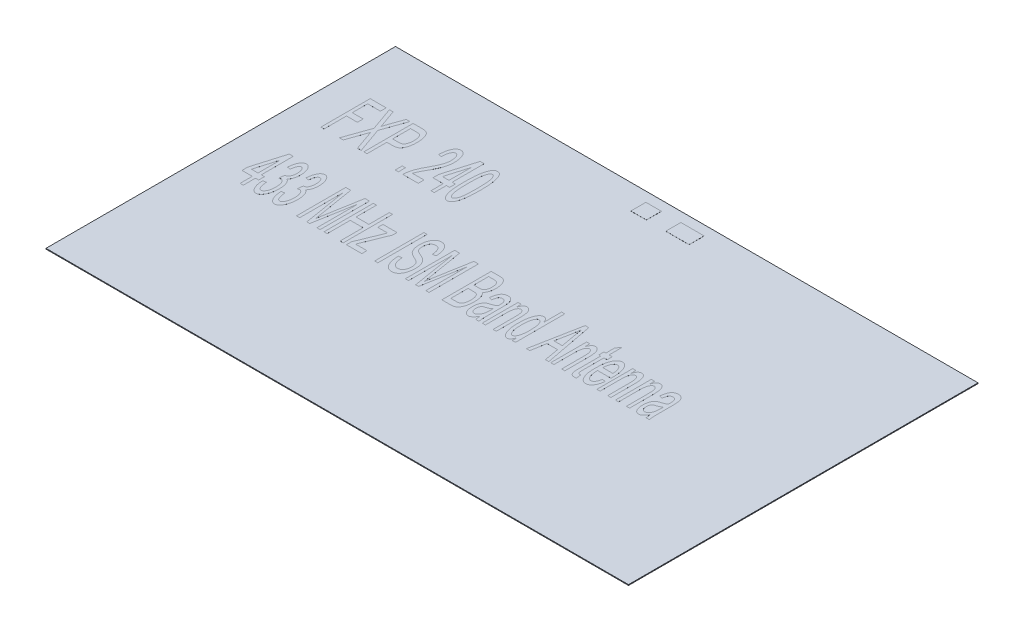
from build123d import *

# Parameters (mm, degrees)
SKETCH1_W           = 75
SKETCH1_H           = 45
BOSS_EXTRUDE1_DEPTH = 0.1
SKETCH2_W           = 2
SKETCH2_H           = 1.937835325
SKETCH2_W_2         = 3
BOSS_EXTRUDE2_DEPTH = 0.01
SKETCH3_W           = 0.412337662
SKETCH3_H           = 0.907142857
SKETCH3_H_2         = 6.35
BOSS_EXTRUDE3_DEPTH = 0.001


with BuildPart() as part:
    # Sketch1 → Boss-Extrude1 (new body)
    with BuildSketch(Plane(origin=(0, 0, 0), x_dir=(1, 0, 0), z_dir=(0, 1, 0))):
        Rectangle(SKETCH1_W, SKETCH1_H)
    extrude(amount=BOSS_EXTRUDE1_DEPTH)

    # Sketch2 → Boss-Extrude2 (add)
    with BuildSketch(Plane(origin=(0, 0.1, 0), x_dir=(1, 0, 0), z_dir=(0, 1, 0))):
        with Locations((-3, 20.269757496)):
            Rectangle(SKETCH2_W, SKETCH2_H)
        with Locations((2, 20.269757496)):
            Rectangle(SKETCH2_W_2, SKETCH2_H)
    extrude(amount=BOSS_EXTRUDE2_DEPTH)

    # Sketch3 → Boss-Extrude3 (add)
    # profile 1 of 27: a face of its own
    with BuildSketch(Plane(origin=(0, 0.1, 0), x_dir=(1, 0, 0), z_dir=(0, 1, 0))):
        Polygon((-33.317623988, 8.70971464), (-33.317623988, 15.05971464), (-31.255935676, 15.05971464), (-31.255935676, 14.317506848), (-32.905286326, 14.317506848), (-32.905286326, 12.338286069), (-31.503338274, 12.338286069), (-31.503338274, 11.596078276), (-32.905286326, 11.596078276), (-32.905286326, 8.70971464), align=None)
    # profile 2 of 27: a face of its own
    with BuildSketch(Plane(origin=(0, 0.1, 0), x_dir=(1, 0, 0), z_dir=(0, 1, 0))):
        with BuildLine():
            Line((-30.926065547, 8.70971464), (-29.763788761, 12.000684608))
            Line((-29.763788761, 12.000684608), (-30.843598014, 15.05971464))
            Line((-30.843598014, 15.05971464), (-30.365544037, 15.05971464))
            Line((-30.365544037, 15.05971464), (-29.797291196, 13.449020647))
            add(Edge.make_bspline(
                [(-29.797291196, 13.449020647), (-29.768903747, 13.370003328), (-29.715391557, 13.221050534), (-29.640606253, 13.011032306), (-29.576355263, 12.828423891), (-29.536987745, 12.715838094), (-29.518963274, 12.664290533)],
                knots=[0, 0, 0, 0, 1.210070001, 2.281060783, 3.212981338, 4, 4, 4, 4], degree=3))
            add(Edge.make_bspline(
                [(-29.518963274, 12.664290533), (-29.481135157, 12.779537196), (-29.402171127, 13.020108011), (-29.317991, 13.258904503), (-29.274137787, 13.383304332)],
                knots=[0, 0, 0, 0, 0.958110091, 2, 2, 2, 2], degree=3))
            Line((-29.274137787, 13.383304332), (-28.682690952, 15.05971464))
            Line((-28.682690952, 15.05971464), (-28.204636975, 15.05971464))
            Line((-28.204636975, 15.05971464), (-29.284446228, 11.999396052))
            Line((-29.284446228, 11.999396052), (-28.122169443, 8.70971464))
            Line((-28.122169443, 8.70971464), (-28.601511975, 8.70971464))
            Line((-28.601511975, 8.70971464), (-29.408147527, 10.993034445))
            add(Edge.make_bspline(
                [(-29.408147527, 10.993034445), (-29.42860599, 11.052363968), (-29.466470527, 11.162171087), (-29.505963048, 11.271402892), (-29.524117495, 11.32161602)],
                knots=[0, 0, 0, 0, 1.080613418, 2, 2, 2, 2], degree=3))
            add(Edge.make_bspline(
                [(-29.524117495, 11.32161602), (-29.538974888, 11.27860176), (-29.566651886, 11.198472926), (-29.607553204, 11.088301327), (-29.63865708, 10.995253701), (-29.659286244, 10.940157406), (-29.668435676, 10.915721134)],
                knots=[0, 0, 0, 0, 1.267598891, 2.361338341, 3.273221855, 4, 4, 4, 4], degree=3))
            Line((-29.668435676, 10.915721134), (-30.446723014, 8.70971464))
            Line((-30.446723014, 8.70971464), (-30.926065547, 8.70971464))
        make_face()
    # profile 3 of 27: a face of its own
    with BuildSketch(Plane(origin=(0, 0.1, 0), x_dir=(1, 0, 0), z_dir=(0, 1, 0))):
        with BuildLine():
            Line((-27.792299313, 8.70971464), (-27.792299313, 15.05971464))
            Line((-27.792299313, 15.05971464), (-26.610694199, 15.05971464))
            add(Edge.make_bspline(
                [(-26.610694199, 15.05971464), (-26.545721616, 15.058512328), (-26.423897336, 15.056257979), (-26.25569046, 15.032891448), (-26.111812322, 14.998889868), (-26.031960242, 14.956873359), (-25.994764816, 14.937301897)],
                knots=[0, 0, 0, 0, 1.226903482, 2.30045698, 3.208345911, 4, 4, 4, 4], degree=3))
            add(Edge.make_bspline(
                [(-25.994764816, 14.937301897), (-25.972448269, 14.922817119), (-25.926611091, 14.893066042), (-25.864481237, 14.836964758), (-25.804505221, 14.773577088), (-25.749048348, 14.700878565), (-25.697745825, 14.618954346), (-25.648507386, 14.528847578), (-25.60393044, 14.428961818), (-25.54592167, 14.282386965), (-25.486795615, 14.079837099), (-25.435268195, 13.816003719), (-25.406540109, 13.526109234), (-25.402725305, 13.324522045), (-25.400740871, 13.219657822)],
                knots=[0, 0, 0, 0, 0.507281481, 1.041933229, 1.593123535, 2.172164256, 2.78418358, 3.437401533, 4.131068468, 4.871222433, 6.446212683, 8.151112283, 9.997835967, 12, 12, 12, 12], degree=3))
            add(Edge.make_bspline(
                [(-25.400740871, 13.219657822), (-25.401326178, 13.14919439), (-25.402469289, 13.011578431), (-25.415930119, 12.810389384), (-25.436274708, 12.619483783), (-25.464143419, 12.438224015), (-25.501755972, 12.267134576), (-25.546087177, 12.105340685), (-25.60107529, 11.954217654), (-25.661275402, 11.812554588), (-25.732913199, 11.684048668), (-25.81731528, 11.572102487), (-25.913136157, 11.476042292), (-26.023497767, 11.399942485), (-26.143985946, 11.3382887), (-26.277557356, 11.295712565), (-26.422982008, 11.271674774), (-26.523840981, 11.268069267), (-26.575903209, 11.266208147)],
                knots=[0, 0, 0, 0, 1.315155216, 2.56851447, 3.762077592, 4.898358266, 5.989794137, 7.0305778, 8.02728344, 8.989564793, 9.90152797, 10.765863298, 11.599300533, 12.422336858, 13.257815654, 14.117377673, 15.028212269, 16, 16, 16, 16], degree=3))
            Line((-26.575903209, 11.266208147), (-27.379961651, 11.266208147))
            Line((-27.379961651, 11.266208147), (-27.379961651, 8.70971464))
            Line((-27.379961651, 8.70971464), (-27.792299313, 8.70971464))
        make_face()
        with BuildLine():
            Line((-27.379961651, 12.008415939), (-26.559151991, 12.008415939))
            add(Edge.make_bspline(
                [(-26.559151991, 12.008415939), (-26.527760718, 12.009565383), (-26.467282769, 12.011779884), (-26.379266209, 12.024301727), (-26.297977029, 12.047737426), (-26.222729984, 12.079648023), (-26.15468417, 12.121555142), (-26.09364558, 12.172793551), (-26.037712294, 12.231811361), (-25.989828425, 12.30188339), (-25.947633774, 12.380109523), (-25.911453789, 12.467880172), (-25.880336583, 12.564720869), (-25.856852214, 12.671434586), (-25.837334163, 12.786677122), (-25.823514116, 12.911000542), (-25.814077841, 13.044697978), (-25.813418561, 13.137172578), (-25.813078534, 13.184866832)],
                knots=[0, 0, 0, 0, 0.953135346, 1.836296075, 2.690499218, 3.513902775, 4.309913047, 5.106136813, 5.92705961, 6.76974398, 7.67392057, 8.62061453, 9.64723894, 10.757307299, 11.933972537, 13.193722632, 14.552647937, 16, 16, 16, 16], degree=3))
            add(Edge.make_bspline(
                [(-25.813078534, 13.184866832), (-25.813898354, 13.246756561), (-25.815478685, 13.366058599), (-25.832248056, 13.537990033), (-25.860338903, 13.695697499), (-25.898589439, 13.838360855), (-25.944442381, 13.963139601), (-25.993413433, 14.069555013), (-26.050179504, 14.153069881), (-26.113880166, 14.21897267), (-26.194447955, 14.267316009), (-26.297749443, 14.29537365), (-26.423963216, 14.314905332), (-26.516526521, 14.316590224), (-26.566883323, 14.317506848)],
                knots=[0, 0, 0, 0, 1.417302907, 2.732070855, 3.951738139, 5.083004442, 6.110183006, 6.994671366, 7.758794529, 8.412746051, 9.079233119, 9.882148566, 10.847834754, 12, 12, 12, 12], degree=3))
            Line((-26.566883323, 14.317506848), (-27.379961651, 14.317506848))
            Line((-27.379961651, 14.317506848), (-27.379961651, 12.008415939))
        make_face(mode=Mode.SUBTRACT)
    # profile 4 of 27: a face of its own
    with BuildSketch(Plane(origin=(0, 0.1, 0), x_dir=(1, 0, 0), z_dir=(0, 1, 0))):
        with Locations((-23.545221391, 9.163286068)):
            Rectangle(SKETCH3_W, SKETCH3_H)
    # profile 5 of 27: a face of its own
    with BuildSketch(Plane(origin=(0, 0.1, 0), x_dir=(1, 0, 0), z_dir=(0, 1, 0))):
        with BuildLine():
            Line((-20.782559053, 9.451922432), (-20.782559053, 8.70971464))
            Line((-20.782559053, 8.70971464), (-22.761779832, 8.70971464))
            add(Edge.make_bspline(
                [(-22.761779832, 8.70971464), (-22.761075481, 8.787969274), (-22.759619655, 8.94971411), (-22.728664502, 9.199011952), (-22.679876252, 9.462080877), (-22.621331476, 9.689332578), (-22.561930854, 9.878811955), (-22.509313888, 10.02992513), (-22.446469033, 10.187081274), (-22.378107878, 10.351516164), (-22.298210875, 10.521122202), (-22.210730365, 10.697119501), (-22.115436064, 10.880175144), (-22.047730061, 11.003471922), (-22.013129264, 11.066482091)],
                knots=[0, 0, 0, 0, 1.12558031, 2.326466745, 3.609323851, 4.975304688, 5.700729609, 6.467169685, 7.27767141, 8.136526564, 9.029888238, 9.975437656, 10.965358074, 12, 12, 12, 12], degree=3))
            add(Edge.make_bspline(
                [(-22.013129264, 11.066482091), (-21.972592302, 11.139410777), (-21.894149694, 11.280534237), (-21.783162292, 11.486412787), (-21.683723346, 11.6796373), (-21.596091282, 11.860290802), (-21.518698509, 12.027803331), (-21.450894114, 12.182417704), (-21.395606155, 12.324784247), (-21.337625629, 12.495646982), (-21.281059984, 12.696706984), (-21.231144056, 12.930265762), (-21.201862086, 13.155773856), (-21.197185864, 13.303336672), (-21.194896715, 13.375573)],
                knots=[0, 0, 0, 0, 1.212452123, 2.34620216, 3.398569735, 4.36999545, 5.263637503, 6.079910652, 6.822881189, 7.482117195, 8.701249987, 9.855583924, 10.950245395, 12, 12, 12, 12], degree=3))
            add(Edge.make_bspline(
                [(-21.194896715, 13.375573), (-21.196360306, 13.453411764), (-21.199160903, 13.602357065), (-21.227493472, 13.814514195), (-21.273959458, 14.004519069), (-21.331110735, 14.145265691), (-21.383575367, 14.244019699), (-21.424321308, 14.307523112), (-21.468617216, 14.360994704), (-21.514631231, 14.405130782), (-21.563276189, 14.439471568), (-21.613906138, 14.464685329), (-21.667448978, 14.479091931), (-21.703797394, 14.481327541), (-21.72191579, 14.482441913)],
                knots=[0, 0, 0, 0, 2.103255141, 4.024601076, 5.773473926, 7.377712879, 8.115386787, 8.794933212, 9.413403032, 9.988378184, 10.513470303, 11.017201274, 11.510109695, 12, 12, 12, 12], degree=3))
            add(Edge.make_bspline(
                [(-21.72191579, 14.482441913), (-21.741392163, 14.481611235), (-21.780234857, 14.479954573), (-21.836082944, 14.461509364), (-21.890293377, 14.435935104), (-21.941052058, 14.397415717), (-21.988026604, 14.34786697), (-22.03405206, 14.289154557), (-22.075863217, 14.219079019), (-22.115932901, 14.139155473), (-22.151553672, 14.049445783), (-22.182306195, 13.950250625), (-22.209987353, 13.84210096), (-22.229257404, 13.723801292), (-22.24620834, 13.596634678), (-22.259547637, 13.460441762), (-22.265124736, 13.314628626), (-22.266345945, 13.214505808), (-22.266974638, 13.162961393)],
                knots=[0, 0, 0, 0, 0.602123897, 1.200845519, 1.80884107, 2.456586426, 3.163472177, 3.92328399, 4.766746185, 5.690616594, 6.695443825, 7.757676376, 8.911682509, 10.156261896, 11.473845891, 12.892884722, 14.400420176, 16, 16, 16, 16], degree=3))
            Line((-22.266974638, 13.162961393), (-22.6793123, 13.245428926))
            add(Edge.make_bspline(
                [(-22.6793123, 13.245428926), (-22.67569362, 13.32192999), (-22.668689915, 13.469992533), (-22.647462739, 13.6844098), (-22.621016774, 13.883956272), (-22.587475281, 14.068855381), (-22.548208562, 14.239508568), (-22.500708828, 14.39533406), (-22.446604964, 14.536646022), (-22.386379061, 14.663699001), (-22.319312896, 14.775397194), (-22.248927456, 14.874023583), (-22.170210731, 14.955485495), (-22.088797837, 15.024769709), (-22.000511537, 15.077031999), (-21.907898656, 15.115447379), (-21.809266065, 15.137431785), (-21.741776371, 15.140589669), (-21.707741683, 15.142182173)],
                knots=[0, 0, 0, 0, 1.575334039, 3.048950592, 4.431083688, 5.715384449, 6.913504118, 8.031561381, 9.063740694, 10.024132582, 10.919738645, 11.741558131, 12.510312565, 13.244573161, 13.934084429, 14.611774139, 15.2999252, 16, 16, 16, 16], degree=3))
            add(Edge.make_bspline(
                [(-21.707741683, 15.142182173), (-21.670677641, 15.140314278), (-21.598293175, 15.136666362), (-21.492844833, 15.111879383), (-21.395184322, 15.068251102), (-21.303472803, 15.008553651), (-21.221264033, 14.92939178), (-21.144171123, 14.835456865), (-21.074863487, 14.723994464), (-20.993347039, 14.551466748), (-20.907557955, 14.315966275), (-20.834746629, 14.014276833), (-20.789905343, 13.69433608), (-20.785045581, 13.474941889), (-20.782559053, 13.362687449)],
                knots=[0, 0, 0, 0, 0.60577358, 1.183049505, 1.758315425, 2.346376952, 2.962277382, 3.615802465, 4.328736634, 5.101168843, 6.73147447, 8.415525931, 10.165980915, 12, 12, 12, 12], degree=3))
            add(Edge.make_bspline(
                [(-20.782559053, 13.362687449), (-20.78478631, 13.261227547), (-20.789206883, 13.059853874), (-20.824691732, 12.761048975), (-20.884523676, 12.469186856), (-20.952947032, 12.228825922), (-21.021423552, 12.032909379), (-21.085636201, 11.875095912), (-21.156792185, 11.704564302), (-21.242296803, 11.523800663), (-21.335288208, 11.329976516), (-21.440063082, 11.124580791), (-21.556402367, 10.908729565), (-21.637620455, 10.761034146), (-21.679393469, 10.685069754)],
                knots=[0, 0, 0, 0, 1.277335655, 2.535206207, 3.7825915, 5.025489654, 5.678912608, 6.39500394, 7.170516819, 8.005338874, 8.912453825, 9.877565631, 10.908365353, 12, 12, 12, 12], degree=3))
            add(Edge.make_bspline(
                [(-21.679393469, 10.685069754), (-21.706086894, 10.637858441), (-21.757194082, 10.547467737), (-21.829439446, 10.417364209), (-21.89349953, 10.299045368), (-21.950991964, 10.192713735), (-22.000131639, 10.097638777), (-22.045541391, 10.015562431), (-22.079147875, 9.943225919), (-22.134260345, 9.830310112), (-22.1997527, 9.668789117), (-22.244771913, 9.5235513), (-22.266974638, 9.451922432)],
                knots=[0, 0, 0, 0, 1.188137571, 2.27480628, 3.260070247, 4.13571315, 4.922802477, 5.604717793, 6.189700241, 6.669494183, 8.357450123, 10, 10, 10, 10], degree=3))
            Line((-22.266974638, 9.451922432), (-20.782559053, 9.451922432))
        make_face()
    # profile 6 of 27: a face of its own
    with BuildSketch(Plane(origin=(0, 0.1, 0), x_dir=(1, 0, 0), z_dir=(0, 1, 0))):
        Polygon((-19.133208404, 8.70971464), (-19.133208404, 10.276597757), (-20.452688923, 10.276597757), (-20.452688923, 11.018805549), (-19.23886993, 15.142182173), (-18.720870741, 15.142182173), (-18.720870741, 11.018805549), (-18.308533079, 11.018805549), (-18.308533079, 10.276597757), (-18.720870741, 10.276597757), (-18.720870741, 8.70971464), align=None)
        Polygon((-19.133208404, 11.018805549), (-19.133208404, 13.888417968), (-19.978500612, 11.018805549), align=None, mode=Mode.SUBTRACT)
    # profile 7 of 27: a face of its own
    with BuildSketch(Plane(origin=(0, 0.1, 0), x_dir=(1, 0, 0), z_dir=(0, 1, 0))):
        with BuildLine():
            add(Edge.make_bspline(
                [(-17.978662949, 11.88213753), (-17.97797805, 12.011862406), (-17.976648781, 12.263635433), (-17.964821001, 12.628818399), (-17.946479917, 12.970089666), (-17.917519457, 13.286226123), (-17.884069079, 13.57876461), (-17.839891715, 13.845979155), (-17.790635071, 14.08977161), (-17.73204634, 14.308570355), (-17.664883638, 14.502588108), (-17.593076206, 14.672308724), (-17.511318486, 14.815890664), (-17.423304104, 14.934953973), (-17.325347671, 15.027702282), (-17.219384575, 15.093544129), (-17.105416537, 15.135084013), (-17.026332008, 15.139803615), (-16.986475449, 15.142182173)],
                knots=[0, 0, 0, 0, 1.70868799, 3.31626098, 4.81228378, 6.209614845, 7.497331272, 8.689735957, 9.776015288, 10.77240054, 11.670592436, 12.478861393, 13.19604247, 13.842152518, 14.422576634, 14.96112221, 15.476432445, 16, 16, 16, 16], degree=3))
            add(Edge.make_bspline(
                [(-16.986475449, 15.142182173), (-16.951035592, 15.140212748), (-16.880491608, 15.136292555), (-16.777871322, 15.104035942), (-16.682453217, 15.049741587), (-16.59388544, 14.974280824), (-16.51133002, 14.878724074), (-16.433724422, 14.762902584), (-16.363376538, 14.625323353), (-16.323307244, 14.524900922), (-16.302252641, 14.472133471)],
                knots=[0, 0, 0, 0, 0.831666722, 1.655454838, 2.500611884, 3.396282926, 4.376267156, 5.459753634, 6.665215282, 8, 8, 8, 8], degree=3))
            add(Edge.make_bspline(
                [(-16.302252641, 14.472133471), (-16.277584025, 14.399860412), (-16.225445125, 14.247106081), (-16.165011942, 13.998318303), (-16.114355218, 13.719824352), (-16.072209687, 13.410666277), (-16.03904572, 13.071546933), (-16.016712633, 12.701902851), (-16.002377124, 12.302319741), (-16.000444319, 12.025609982), (-15.99944217, 11.88213753)],
                knots=[0, 0, 0, 0, 0.699483955, 1.478409845, 2.34299167, 3.292566601, 4.336638456, 5.464497721, 6.685356343, 8, 8, 8, 8], degree=3))
            add(Edge.make_bspline(
                [(-15.99944217, 11.88213753), (-16.000139868, 11.753273221), (-16.001493704, 11.503220846), (-16.013168226, 11.139735039), (-16.032192141, 10.800295959), (-16.058346739, 10.484715259), (-16.095171889, 10.193528567), (-16.13602794, 9.925286919), (-16.187987565, 9.681662846), (-16.245261222, 9.461991759), (-16.309320809, 9.266793558), (-16.38493256, 9.098355765), (-16.464450733, 8.953687974), (-16.554470681, 8.835760229), (-16.650954964, 8.741627312), (-16.757495811, 8.675948677), (-16.871792013, 8.634177788), (-16.951331406, 8.629577714), (-16.99162967, 8.627247108)],
                knots=[0, 0, 0, 0, 1.69937339, 3.297517795, 4.795303428, 6.182500664, 7.472418658, 8.665327741, 9.759592672, 10.755687533, 11.658463109, 12.464784968, 13.187731847, 13.830098836, 14.415086401, 14.95426657, 15.47018402, 16, 16, 16, 16], degree=3))
            add(Edge.make_bspline(
                [(-16.99162967, 8.627247108), (-17.027097027, 8.629606625), (-17.09832242, 8.634344997), (-17.202589501, 8.669428117), (-17.300102839, 8.728934278), (-17.390937876, 8.811802208), (-17.479691567, 8.914024599), (-17.559502183, 9.041980076), (-17.635266816, 9.191486008), (-17.708679822, 9.364230173), (-17.772298274, 9.566224142), (-17.829319743, 9.799322282), (-17.873672522, 10.06614854), (-17.912074537, 10.365312836), (-17.942879681, 10.69751634), (-17.963997845, 11.062814124), (-17.976976714, 11.461543648), (-17.978086031, 11.738238188), (-17.978662949, 11.88213753)],
                knots=[0, 0, 0, 0, 0.468052298, 0.939940594, 1.436202609, 1.966763693, 2.55818257, 3.219208114, 3.952566995, 4.771357547, 5.695434233, 6.746803233, 7.938926263, 9.266226691, 10.730758903, 12.345025763, 14.099173237, 16, 16, 16, 16], degree=3))
        make_face()
        with BuildLine():
            add(Edge.make_bspline(
                [(-17.566325287, 11.88471464), (-17.565883409, 11.76100885), (-17.565039449, 11.524738362), (-17.557278004, 11.185792432), (-17.544843214, 10.879034646), (-17.527240262, 10.603582054), (-17.504140989, 10.360823902), (-17.47805086, 10.149090572), (-17.445810141, 9.969397712), (-17.406202695, 9.81902919), (-17.363931438, 9.693019719), (-17.316083135, 9.586831712), (-17.270624587, 9.494347826), (-17.21789885, 9.420337728), (-17.164817734, 9.359822886), (-17.104986584, 9.320253683), (-17.044516069, 9.290633239), (-17.001412548, 9.288196179), (-16.980032673, 9.286987367)],
                knots=[0, 0, 0, 0, 2.119927175, 4.048931165, 5.809673086, 7.380881043, 8.778344621, 9.988051846, 11.036167299, 11.903853888, 12.651062693, 13.31024443, 13.899558755, 14.412118004, 14.86520363, 15.26742291, 15.636632779, 16, 16, 16, 16], degree=3))
            add(Edge.make_bspline(
                [(-16.980032673, 9.286987367), (-16.959972367, 9.288299013), (-16.919011744, 9.290977228), (-16.861110067, 9.319799688), (-16.805928299, 9.362417703), (-16.753027886, 9.421234341), (-16.704460546, 9.497466971), (-16.658664207, 9.589902611), (-16.613366436, 9.698053268), (-16.571924764, 9.826058309), (-16.532784028, 9.977244772), (-16.499717808, 10.157620442), (-16.474131457, 10.369440542), (-16.450880783, 10.612169686), (-16.433301076, 10.886338362), (-16.420790437, 11.191373917), (-16.413092046, 11.527745403), (-16.412229835, 11.762297579), (-16.411779832, 11.88471464)],
                knots=[0, 0, 0, 0, 0.343204814, 0.700781057, 1.091422776, 1.541808841, 2.054805418, 2.64374954, 3.316995304, 4.072673413, 4.959112632, 6.005312501, 7.228541206, 8.633147961, 10.205004894, 11.959963334, 13.891431127, 16, 16, 16, 16], degree=3))
            add(Edge.make_bspline(
                [(-16.411779832, 11.88471464), (-16.412234035, 12.008420147), (-16.413104688, 12.245548916), (-16.42073915, 12.584927869), (-16.4333385, 12.892539779), (-16.450848028, 13.16756244), (-16.473688973, 13.410841793), (-16.50137421, 13.622021169), (-16.533846044, 13.80165895), (-16.572617841, 13.951491713), (-16.616683248, 14.076555065), (-16.660666671, 14.184109257), (-16.709495191, 14.274867685), (-16.761255337, 14.349337662), (-16.815112219, 14.409215776), (-16.873923324, 14.451360689), (-16.936601556, 14.478361131), (-16.980207654, 14.481084675), (-17.001938112, 14.482441913)],
                knots=[0, 0, 0, 0, 2.117581359, 4.059152046, 5.810599527, 7.387405635, 8.776003601, 9.992620565, 11.032348157, 11.899074603, 12.638507249, 13.300807084, 13.886430904, 14.398422978, 14.851007241, 15.256997728, 15.62973576, 16, 16, 16, 16], degree=3))
            add(Edge.make_bspline(
                [(-17.001938112, 14.482441913), (-17.022001764, 14.481133465), (-17.062969218, 14.478461778), (-17.120816358, 14.4495872), (-17.176008946, 14.40737324), (-17.227923501, 14.347522832), (-17.275890389, 14.270912041), (-17.322086086, 14.178268908), (-17.367238294, 14.070063198), (-17.408872777, 13.942652773), (-17.446469804, 13.791170207), (-17.479674622, 13.610955433), (-17.50507825, 13.39911114), (-17.529005284, 13.156892825), (-17.544251136, 12.8830274), (-17.557486154, 12.578066581), (-17.564963729, 12.241680649), (-17.565858362, 12.007130594), (-17.566325287, 11.88471464)],
                knots=[0, 0, 0, 0, 0.343383068, 0.701145029, 1.09198964, 1.537657945, 2.057128411, 2.646378419, 3.319973854, 4.076044448, 4.953940407, 6.007960487, 7.231824514, 8.629792167, 10.201995084, 11.957865016, 13.890335977, 16, 16, 16, 16], degree=3))
        make_face(mode=Mode.SUBTRACT)
    # profile 8 of 27: a face of its own
    with BuildSketch(Plane(origin=(0, 0.1, 0), x_dir=(1, 0, 0), z_dir=(0, 1, 0))):
        Polygon((-32.245546066, -2.763661983), (-32.245546066, -1.196778866), (-33.565026586, -1.196778866), (-33.565026586, -0.454571074), (-32.351207592, 3.668805549), (-31.833208404, 3.668805549), (-31.833208404, -0.454571074), (-31.420870741, -0.454571074), (-31.420870741, -1.196778866), (-31.833208404, -1.196778866), (-31.833208404, -2.763661983), align=None)
        Polygon((-32.245546066, -0.454571074), (-32.245546066, 2.415041345), (-33.090838274, -0.454571074), align=None, mode=Mode.SUBTRACT)
    # profile 9 of 27: a face of its own
    with BuildSketch(Plane(origin=(0, 0.1, 0), x_dir=(1, 0, 0), z_dir=(0, 1, 0))):
        with BuildLine():
            Line((-31.091000612, -1.031843801), (-30.678662949, -0.949376269))
            add(Edge.make_bspline(
                [(-30.678662949, -0.949376269), (-30.673807336, -0.999234909), (-30.66437606, -1.096077605), (-30.645790202, -1.236008295), (-30.627364783, -1.366909734), (-30.603993422, -1.487607079), (-30.578258113, -1.598943738), (-30.550338696, -1.700569179), (-30.519246221, -1.792578892), (-30.4863414, -1.875110721), (-30.449853861, -1.947739381), (-30.412055434, -2.011809452), (-30.368760724, -2.064346676), (-30.325431646, -2.1094259), (-30.278045424, -2.143298138), (-30.228436757, -2.168905852), (-30.175164619, -2.18299653), (-30.138830046, -2.185260665), (-30.12071855, -2.186389256)],
                knots=[0, 0, 0, 0, 1.649829292, 3.204538208, 4.649074362, 6.003070086, 7.252193851, 8.412348008, 9.472630933, 10.449912649, 11.335665562, 12.148481701, 12.893058398, 13.573300442, 14.201536719, 14.802583339, 15.403130266, 16, 16, 16, 16], degree=3))
            add(Edge.make_bspline(
                [(-30.12071855, -2.186389256), (-30.100801977, -2.185608136), (-30.060557375, -2.184029759), (-30.002429297, -2.164215845), (-29.945383017, -2.136079668), (-29.893009279, -2.093053855), (-29.840785014, -2.041537924), (-29.79173349, -1.976958618), (-29.744757415, -1.901268722), (-29.683035796, -1.782894217), (-29.618235299, -1.612819906), (-29.561742114, -1.385430179), (-29.530757352, -1.130189556), (-29.526402692, -0.951604827), (-29.524117495, -0.85788885)],
                knots=[0, 0, 0, 0, 0.454208407, 0.917800316, 1.392937411, 1.90455469, 2.461018029, 3.070989806, 3.756055843, 4.499642669, 6.125453904, 7.910044934, 9.853712712, 12, 12, 12, 12], degree=3))
            add(Edge.make_bspline(
                [(-29.524117495, -0.85788885), (-29.525918407, -0.770176443), (-29.529347427, -0.603168019), (-29.559734142, -0.365360374), (-29.611888197, -0.154651667), (-29.672399547, 0.001896573), (-29.730857755, 0.109792428), (-29.775262568, 0.179040668), (-29.821949977, 0.238570193), (-29.871890527, 0.286342728), (-29.924749778, 0.323155076), (-29.978910744, 0.351215405), (-30.036936232, 0.367124096), (-30.076388231, 0.369106786), (-30.096236001, 0.37010425)],
                knots=[0, 0, 0, 0, 2.146814479, 4.087632684, 5.855053179, 7.450399663, 8.1796946, 8.856374499, 9.462363998, 10.027664774, 10.541097783, 11.034879445, 11.514460842, 12, 12, 12, 12], degree=3))
            add(Edge.make_bspline(
                [(-30.096236001, 0.37010425), (-30.114399414, 0.369102355), (-30.153142125, 0.366965303), (-30.213288958, 0.347629613), (-30.280310084, 0.321460885), (-30.325036726, 0.296003777), (-30.348792819, 0.282482497)],
                knots=[0, 0, 0, 0, 0.805147638, 1.717386614, 2.787613475, 4, 4, 4, 4], degree=3))
            Line((-30.348792819, 0.282482497), (-30.266325287, 1.02984451))
            Line((-30.266325287, 1.02984451), (-30.217360189, 1.020824624))
            add(Edge.make_bspline(
                [(-30.217360189, 1.020824624), (-30.179350729, 1.024345124), (-30.102949475, 1.031421535), (-29.996787301, 1.089108618), (-29.90642556, 1.181762528), (-29.828776487, 1.305951736), (-29.7662519, 1.458601788), (-29.719882842, 1.636174729), (-29.693690787, 1.836988717), (-29.690650075, 1.978572611), (-29.68905256, 2.052957335)],
                knots=[0, 0, 0, 0, 0.714805013, 1.43680016, 2.222639918, 3.138446618, 4.185496547, 5.326696383, 6.595511502, 8, 8, 8, 8], degree=3))
            add(Edge.make_bspline(
                [(-29.68905256, 2.052957335), (-29.690439152, 2.121309531), (-29.693081751, 2.251576739), (-29.715378526, 2.436671035), (-29.75547301, 2.600399297), (-29.807885783, 2.741804797), (-29.872459705, 2.856744547), (-29.944180892, 2.943299985), (-30.027852747, 2.998485293), (-30.088688094, 3.005613957), (-30.118141439, 3.009065289)],
                knots=[0, 0, 0, 0, 1.447584356, 2.758840001, 3.939351213, 5.010579507, 5.943805676, 6.71749565, 7.37907735, 8, 8, 8, 8], degree=3))
            add(Edge.make_bspline(
                [(-30.118141439, 3.009065289), (-30.148845572, 3.006093185), (-30.211295356, 3.000048159), (-30.297063401, 2.94794894), (-30.373219257, 2.868137731), (-30.440435076, 2.758115722), (-30.49815602, 2.617770007), (-30.543005357, 2.446099729), (-30.577256338, 2.243412839), (-30.589609782, 2.097331196), (-30.596195417, 2.0194549)],
                knots=[0, 0, 0, 0, 0.617169293, 1.255273653, 1.974231614, 2.837339959, 3.846046976, 5.035013681, 6.419362285, 8, 8, 8, 8], degree=3))
            Line((-30.596195417, 2.0194549), (-31.008533079, 2.101922432))
            add(Edge.make_bspline(
                [(-31.008533079, 2.101922432), (-31.002722094, 2.164709059), (-30.991429391, 2.286724623), (-30.964629548, 2.462687568), (-30.936284463, 2.627330879), (-30.899279719, 2.779149827), (-30.86049891, 2.920420052), (-30.813700419, 3.049322379), (-30.76291442, 3.166890479), (-30.705682992, 3.271625723), (-30.64571455, 3.364880791), (-30.580816401, 3.445563052), (-30.512894219, 3.513734552), (-30.442359959, 3.570517641), (-30.368536699, 3.615141951), (-30.290605402, 3.646198498), (-30.209641387, 3.664832764), (-30.154745491, 3.667476913), (-30.127161326, 3.668805549)],
                knots=[0, 0, 0, 0, 1.549915096, 3.012007115, 4.374977459, 5.655690372, 6.852406959, 7.974780241, 9.024504968, 9.997941827, 10.905940745, 11.747058044, 12.538585247, 13.267549833, 13.968436719, 14.650862181, 15.322083374, 16, 16, 16, 16], degree=3))
            add(Edge.make_bspline(
                [(-30.127161326, 3.668805549), (-30.098236322, 3.667252953), (-30.040421494, 3.664149649), (-29.955632063, 3.640879674), (-29.873598678, 3.605192862), (-29.796403267, 3.551718828), (-29.723576406, 3.483889674), (-29.651734433, 3.40353353), (-29.58494388, 3.307186213), (-29.523170834, 3.197115498), (-29.465145485, 3.076877646), (-29.415459173, 2.947290386), (-29.3711504, 2.811242746), (-29.336604337, 2.666818478), (-29.309711114, 2.514907428), (-29.290716499, 2.35529637), (-29.278767521, 2.188009155), (-29.277410559, 2.074024704), (-29.276714897, 2.015589234)],
                knots=[0, 0, 0, 0, 0.684946658, 1.369060277, 2.07105099, 2.796859501, 3.582484692, 4.426390969, 5.347315647, 6.355161268, 7.416324921, 8.509255425, 9.642746648, 10.805942152, 12.026336744, 13.298150967, 14.614865317, 16, 16, 16, 16], degree=3))
            add(Edge.make_bspline(
                [(-29.276714897, 2.015589234), (-29.278407471, 1.94511348), (-29.2816969, 1.808147537), (-29.301140027, 1.608675129), (-29.339591065, 1.422379721), (-29.388876794, 1.248779346), (-29.451128169, 1.089605149), (-29.527930141, 0.948972516), (-29.613314369, 0.82333134), (-29.683163912, 0.754385281), (-29.717400774, 0.720591263)],
                knots=[0, 0, 0, 0, 1.20369859, 2.339325261, 3.416730244, 4.447408266, 5.418531639, 6.327622579, 7.180281629, 8, 8, 8, 8], degree=3))
            add(Edge.make_bspline(
                [(-29.717400774, 0.720591263), (-29.685834143, 0.704886729), (-29.622113156, 0.673185263), (-29.537541166, 0.605843209), (-29.460244503, 0.526600005), (-29.392907436, 0.431692674), (-29.332480175, 0.322040518), (-29.27641671, 0.196578237), (-29.230523435, 0.053027468), (-29.187601242, -0.104955991), (-29.153263726, -0.276225805), (-29.128928184, -0.458712103), (-29.114912479, -0.651069418), (-29.112841272, -0.78270018), (-29.111779832, -0.850157519)],
                knots=[0, 0, 0, 0, 0.716652876, 1.44664884, 2.189387476, 2.966695066, 3.809121855, 4.737746231, 5.761772697, 6.876344637, 8.072688451, 9.317880008, 10.625483312, 12, 12, 12, 12], degree=3))
            add(Edge.make_bspline(
                [(-29.111779832, -0.850157519), (-29.112798366, -0.921912781), (-29.114782597, -1.061701071), (-29.129410845, -1.266806962), (-29.152070401, -1.461686402), (-29.184078601, -1.647264948), (-29.226266464, -1.822061744), (-29.278626714, -1.987086787), (-29.337753551, -2.142998628), (-29.409131067, -2.285920296), (-29.483876049, -2.416531728), (-29.565421842, -2.52978903), (-29.648670335, -2.627743286), (-29.736709596, -2.707631658), (-29.829125137, -2.768705042), (-29.924566808, -2.814228873), (-30.024831871, -2.840519455), (-30.093086666, -2.844261423), (-30.127161326, -2.846129516)],
                knots=[0, 0, 0, 0, 1.412908309, 2.75252336, 4.047138178, 5.274991398, 6.458672608, 7.584871474, 8.682797091, 9.738163641, 10.727508631, 11.642900472, 12.482343219, 13.254999138, 13.975180652, 14.656307432, 15.329191915, 16, 16, 16, 16], degree=3))
            add(Edge.make_bspline(
                [(-30.127161326, -2.846129516), (-30.15909209, -2.844678731), (-30.222524958, -2.841796637), (-30.315316539, -2.81740722), (-30.404078086, -2.778307135), (-30.488144957, -2.72307449), (-30.569273563, -2.653549916), (-30.645928393, -2.568430617), (-30.71851472, -2.467340491), (-30.787530605, -2.352494094), (-30.849429442, -2.223883042), (-30.907117202, -2.085346939), (-30.955351518, -1.935102649), (-30.997765242, -1.774728132), (-31.032589961, -1.603924501), (-31.059031901, -1.42275222), (-31.080223777, -1.231097256), (-31.087350627, -1.099328546), (-31.091000612, -1.031843801)],
                knots=[0, 0, 0, 0, 0.685843527, 1.362479842, 2.049069527, 2.763973312, 3.517466276, 4.34144847, 5.220985936, 6.190563156, 7.21928697, 8.288045582, 9.415667669, 10.609959986, 11.854602535, 13.16236881, 14.546720098, 16, 16, 16, 16], degree=3))
        make_face()
    # profile 10 of 27: a face of its own
    with BuildSketch(Plane(origin=(0, 0.1, 0), x_dir=(1, 0, 0), z_dir=(0, 1, 0))):
        with BuildLine():
            Line((-28.69944217, -1.031843801), (-28.287104508, -0.949376269))
            add(Edge.make_bspline(
                [(-28.287104508, -0.949376269), (-28.282248895, -0.999234909), (-28.272817618, -1.096077605), (-28.254231761, -1.236008295), (-28.235806341, -1.366909734), (-28.212434981, -1.487607079), (-28.186699671, -1.598943738), (-28.158780254, -1.700569179), (-28.127687779, -1.792578892), (-28.094782959, -1.875110721), (-28.058295419, -1.947739381), (-28.020496992, -2.011809452), (-27.977202282, -2.064346676), (-27.933873204, -2.1094259), (-27.886486983, -2.143298138), (-27.836878315, -2.168905852), (-27.783606178, -2.18299653), (-27.747271604, -2.185260665), (-27.729160108, -2.186389256)],
                knots=[0, 0, 0, 0, 1.649829292, 3.204538208, 4.649074362, 6.003070086, 7.252193851, 8.412348008, 9.472630933, 10.449912649, 11.335665562, 12.148481701, 12.893058398, 13.573300442, 14.201536719, 14.802583339, 15.403130266, 16, 16, 16, 16], degree=3))
            add(Edge.make_bspline(
                [(-27.729160108, -2.186389256), (-27.709243536, -2.185608136), (-27.668998934, -2.184029759), (-27.610870855, -2.164215845), (-27.553824576, -2.136079668), (-27.501450838, -2.093053855), (-27.449226573, -2.041537924), (-27.400175048, -1.976958618), (-27.353198973, -1.901268722), (-27.291477354, -1.782894217), (-27.226676858, -1.612819906), (-27.170183672, -1.385430179), (-27.139198911, -1.130189556), (-27.13484425, -0.951604827), (-27.132559053, -0.85788885)],
                knots=[0, 0, 0, 0, 0.454208407, 0.917800316, 1.392937411, 1.90455469, 2.461018029, 3.070989806, 3.756055843, 4.499642669, 6.125453904, 7.910044934, 9.853712712, 12, 12, 12, 12], degree=3))
            add(Edge.make_bspline(
                [(-27.132559053, -0.85788885), (-27.134359966, -0.770176443), (-27.137788985, -0.603168019), (-27.1681757, -0.365360374), (-27.220329755, -0.154651667), (-27.280841105, 0.001896573), (-27.339299314, 0.109792428), (-27.383704126, 0.179040668), (-27.430391536, 0.238570193), (-27.480332086, 0.286342728), (-27.533191336, 0.323155076), (-27.587352302, 0.351215405), (-27.64537779, 0.367124096), (-27.68482979, 0.369106786), (-27.70467756, 0.37010425)],
                knots=[0, 0, 0, 0, 2.146814479, 4.087632684, 5.855053179, 7.450399663, 8.1796946, 8.856374499, 9.462363998, 10.027664774, 10.541097783, 11.034879445, 11.514460842, 12, 12, 12, 12], degree=3))
            add(Edge.make_bspline(
                [(-27.70467756, 0.37010425), (-27.722840972, 0.369102355), (-27.761583683, 0.366965303), (-27.821730516, 0.347629613), (-27.888751642, 0.321460885), (-27.933478284, 0.296003777), (-27.957234378, 0.282482497)],
                knots=[0, 0, 0, 0, 0.805147638, 1.717386614, 2.787613475, 4, 4, 4, 4], degree=3))
            Line((-27.957234378, 0.282482497), (-27.874766845, 1.02984451))
            Line((-27.874766845, 1.02984451), (-27.825801748, 1.020824624))
            add(Edge.make_bspline(
                [(-27.825801748, 1.020824624), (-27.787792287, 1.024345124), (-27.711391034, 1.031421535), (-27.60522886, 1.089108618), (-27.514867119, 1.181762528), (-27.437218045, 1.305951736), (-27.374693459, 1.458601788), (-27.3283244, 1.636174729), (-27.302132345, 1.836988717), (-27.299091634, 1.978572611), (-27.297494118, 2.052957335)],
                knots=[0, 0, 0, 0, 0.714805013, 1.43680016, 2.222639918, 3.138446618, 4.185496547, 5.326696383, 6.595511502, 8, 8, 8, 8], degree=3))
            add(Edge.make_bspline(
                [(-27.297494118, 2.052957335), (-27.29888071, 2.121309531), (-27.30152331, 2.251576739), (-27.323820084, 2.436671035), (-27.363914569, 2.600399297), (-27.416327342, 2.741804797), (-27.480901263, 2.856744547), (-27.552622451, 2.943299985), (-27.636294306, 2.998485293), (-27.697129652, 3.005613957), (-27.726582998, 3.009065289)],
                knots=[0, 0, 0, 0, 1.447584356, 2.758840001, 3.939351213, 5.010579507, 5.943805676, 6.71749565, 7.37907735, 8, 8, 8, 8], degree=3))
            add(Edge.make_bspline(
                [(-27.726582998, 3.009065289), (-27.757287131, 3.006093185), (-27.819736914, 3.000048159), (-27.90550496, 2.94794894), (-27.981660816, 2.868137731), (-28.048876634, 2.758115722), (-28.106597578, 2.617770007), (-28.151446915, 2.446099729), (-28.185697897, 2.243412839), (-28.19805134, 2.097331196), (-28.204636975, 2.0194549)],
                knots=[0, 0, 0, 0, 0.617169293, 1.255273653, 1.974231614, 2.837339959, 3.846046976, 5.035013681, 6.419362285, 8, 8, 8, 8], degree=3))
            Line((-28.204636975, 2.0194549), (-28.616974638, 2.101922432))
            add(Edge.make_bspline(
                [(-28.616974638, 2.101922432), (-28.611163652, 2.164709059), (-28.59987095, 2.286724623), (-28.573071106, 2.462687568), (-28.544726022, 2.627330879), (-28.507721278, 2.779149827), (-28.468940469, 2.920420052), (-28.422141977, 3.049322379), (-28.371355978, 3.166890479), (-28.314124551, 3.271625723), (-28.254156109, 3.364880791), (-28.18925796, 3.445563052), (-28.121335778, 3.513734552), (-28.050801517, 3.570517641), (-27.976978257, 3.615141951), (-27.899046961, 3.646198498), (-27.818082946, 3.664832764), (-27.76318705, 3.667476913), (-27.735602884, 3.668805549)],
                knots=[0, 0, 0, 0, 1.549915096, 3.012007115, 4.374977459, 5.655690372, 6.852406959, 7.974780241, 9.024504968, 9.997941827, 10.905940745, 11.747058044, 12.538585247, 13.267549833, 13.968436719, 14.650862181, 15.322083374, 16, 16, 16, 16], degree=3))
            add(Edge.make_bspline(
                [(-27.735602884, 3.668805549), (-27.706677881, 3.667252953), (-27.648863053, 3.664149649), (-27.564073621, 3.640879674), (-27.482040237, 3.605192862), (-27.404844825, 3.551718828), (-27.332017965, 3.483889674), (-27.260175991, 3.40353353), (-27.193385439, 3.307186213), (-27.131612393, 3.197115498), (-27.073587044, 3.076877646), (-27.023900732, 2.947290386), (-26.979591958, 2.811242746), (-26.945045895, 2.666818478), (-26.918152672, 2.514907428), (-26.899158058, 2.35529637), (-26.887209079, 2.188009155), (-26.885852118, 2.074024704), (-26.885156456, 2.015589234)],
                knots=[0, 0, 0, 0, 0.684946658, 1.369060277, 2.07105099, 2.796859501, 3.582484692, 4.426390969, 5.347315647, 6.355161268, 7.416324921, 8.509255425, 9.642746648, 10.805942152, 12.026336744, 13.298150967, 14.614865317, 16, 16, 16, 16], degree=3))
            add(Edge.make_bspline(
                [(-26.885156456, 2.015589234), (-26.88684903, 1.94511348), (-26.890138458, 1.808147537), (-26.909581585, 1.608675129), (-26.948032624, 1.422379721), (-26.997318353, 1.248779346), (-27.059569728, 1.089605149), (-27.136371699, 0.948972516), (-27.221755927, 0.82333134), (-27.291605471, 0.754385281), (-27.325842332, 0.720591263)],
                knots=[0, 0, 0, 0, 1.20369859, 2.339325261, 3.416730244, 4.447408266, 5.418531639, 6.327622579, 7.180281629, 8, 8, 8, 8], degree=3))
            add(Edge.make_bspline(
                [(-27.325842332, 0.720591263), (-27.294275702, 0.704886729), (-27.230554714, 0.673185263), (-27.145982725, 0.605843209), (-27.068686061, 0.526600005), (-27.001348994, 0.431692674), (-26.940921733, 0.322040518), (-26.884858268, 0.196578237), (-26.838964993, 0.053027468), (-26.796042801, -0.104955991), (-26.761705284, -0.276225805), (-26.737369743, -0.458712103), (-26.723354037, -0.651069418), (-26.72128283, -0.78270018), (-26.720221391, -0.850157519)],
                knots=[0, 0, 0, 0, 0.716652876, 1.44664884, 2.189387476, 2.966695066, 3.809121855, 4.737746231, 5.761772697, 6.876344637, 8.072688451, 9.317880008, 10.625483312, 12, 12, 12, 12], degree=3))
            add(Edge.make_bspline(
                [(-26.720221391, -0.850157519), (-26.721239924, -0.921912781), (-26.723224156, -1.061701071), (-26.737852403, -1.266806962), (-26.76051196, -1.461686402), (-26.79252016, -1.647264948), (-26.834708023, -1.822061744), (-26.887068272, -1.987086787), (-26.94619511, -2.142998628), (-27.017572625, -2.285920296), (-27.092317608, -2.416531728), (-27.1738634, -2.52978903), (-27.257111893, -2.627743286), (-27.345151154, -2.707631658), (-27.437566696, -2.768705042), (-27.533008367, -2.814228873), (-27.63327343, -2.840519455), (-27.701528224, -2.844261423), (-27.735602884, -2.846129516)],
                knots=[0, 0, 0, 0, 1.412908309, 2.75252336, 4.047138178, 5.274991398, 6.458672608, 7.584871474, 8.682797091, 9.738163641, 10.727508631, 11.642900472, 12.482343219, 13.254999138, 13.975180652, 14.656307432, 15.329191915, 16, 16, 16, 16], degree=3))
            add(Edge.make_bspline(
                [(-27.735602884, -2.846129516), (-27.767533648, -2.844678731), (-27.830966516, -2.841796637), (-27.923758097, -2.81740722), (-28.012519644, -2.778307135), (-28.096586516, -2.72307449), (-28.177715122, -2.653549916), (-28.254369951, -2.568430617), (-28.326956279, -2.467340491), (-28.395972163, -2.352494094), (-28.457871001, -2.223883042), (-28.515558761, -2.085346939), (-28.563793076, -1.935102649), (-28.6062068, -1.774728132), (-28.64103152, -1.603924501), (-28.66747346, -1.42275222), (-28.688665335, -1.231097256), (-28.695792186, -1.099328546), (-28.69944217, -1.031843801)],
                knots=[0, 0, 0, 0, 0.685843527, 1.362479842, 2.049069527, 2.763973312, 3.517466276, 4.34144847, 5.220985936, 6.190563156, 7.21928697, 8.288045582, 9.415667669, 10.609959986, 11.854602535, 13.16236881, 14.546720098, 16, 16, 16, 16], degree=3))
        make_face()
    # profile 11 of 27: a face of its own
    with BuildSketch(Plane(origin=(0, 0.1, 0), x_dir=(1, 0, 0), z_dir=(0, 1, 0))):
        with BuildLine():
            Line((-24.988403209, -2.763661983), (-24.988403209, 3.586338017))
            Line((-24.988403209, 3.586338017), (-24.351856943, 3.586338017))
            Line((-24.351856943, 3.586338017), (-23.610937706, -0.909431058))
            Line((-23.610937706, -0.909431058), (-23.462753858, -1.85007635))
            add(Edge.make_bspline(
                [(-23.462753858, -1.85007635), (-23.45760589, -1.819149984), (-23.446811376, -1.75430206), (-23.429601977, -1.651722381), (-23.41279173, -1.538837962), (-23.389370121, -1.416902783), (-23.36857465, -1.284703409), (-23.343310142, -1.143168956), (-23.318121645, -0.990945881), (-23.299636838, -0.886219897), (-23.290087462, -0.832117746)],
                knots=[0, 0, 0, 0, 0.728750643, 1.528080172, 2.417705408, 3.381234782, 4.413631526, 5.528114122, 6.723007072, 8, 8, 8, 8], degree=3))
            Line((-23.290087462, -0.832117746), (-22.514377235, 3.586338017))
            Line((-22.514377235, 3.586338017), (-21.937104508, 3.586338017))
            Line((-21.937104508, 3.586338017), (-21.937104508, -2.763661983))
            Line((-21.937104508, -2.763661983), (-22.34944217, -2.763661983))
            Line((-22.34944217, -2.763661983), (-22.34944217, 2.559359526))
            Line((-22.34944217, 2.559359526), (-23.278490465, -2.763661983))
            Line((-23.278490465, -2.763661983), (-23.656037138, -2.763661983))
            Line((-23.656037138, -2.763661983), (-24.576065547, 2.866035663))
            Line((-24.576065547, 2.866035663), (-24.576065547, -2.763661983))
            Line((-24.576065547, -2.763661983), (-24.988403209, -2.763661983))
        make_face()
    # profile 12 of 27: a face of its own
    with BuildSketch(Plane(origin=(0, 0.1, 0), x_dir=(1, 0, 0), z_dir=(0, 1, 0))):
        Polygon((-21.442299313, -2.763661983), (-21.442299313, 3.586338017), (-21.029961651, 3.586338017), (-21.029961651, 0.947376978), (-19.380611001, 0.947376978), (-19.380611001, 3.586338017), (-18.968273339, 3.586338017), (-18.968273339, -2.763661983), (-19.380611001, -2.763661983), (-19.380611001, 0.205169186), (-21.029961651, 0.205169186), (-21.029961651, -2.763661983), align=None)
    # profile 13 of 27: a face of its own
    with BuildSketch(Plane(origin=(0, 0.1, 0), x_dir=(1, 0, 0), z_dir=(0, 1, 0))):
        with BuildLine():
            Line((-18.555935676, -2.763661983), (-18.555935676, -2.103921724))
            Line((-18.555935676, -2.103921724), (-17.209395498, 1.194779575))
            add(Edge.make_bspline(
                [(-17.209395498, 1.194779575), (-17.281554589, 1.194779575), (-17.416423366, 1.194779575), (-17.551292143, 1.194779575), (-17.614001829, 1.194779575)],
                knots=[0, 0, 0, 0, 1.070063694, 2, 2, 2, 2], degree=3))
            Line((-17.614001829, 1.194779575), (-18.473468144, 1.194779575))
            Line((-18.473468144, 1.194779575), (-18.473468144, 1.854519835))
            Line((-18.473468144, 1.854519835), (-16.65918243, 1.854519835))
            Line((-16.65918243, 1.854519835), (-16.65918243, 1.293998325))
            Line((-16.65918243, 1.293998325), (-17.822747771, -1.579479759))
            Line((-17.822747771, -1.579479759), (-18.046956375, -2.103921724))
            add(Edge.make_bspline(
                [(-18.046956375, -2.103921724), (-17.967065952, -2.103921724), (-17.812439329, -2.103921724), (-17.657812706, -2.103921724), (-17.583076504, -2.103921724)],
                knots=[0, 0, 0, 0, 1.033333333, 2, 2, 2, 2], degree=3))
            Line((-17.583076504, -2.103921724), (-16.576714897, -2.103921724))
            Line((-16.576714897, -2.103921724), (-16.576714897, -2.763661983))
            Line((-16.576714897, -2.763661983), (-18.555935676, -2.763661983))
        make_face()
    # profile 14 of 27: a face of its own
    with BuildSketch(Plane(origin=(0, 0.1, 0), x_dir=(1, 0, 0), z_dir=(0, 1, 0))):
        with Locations((-14.721195417, 0.411338017)):
            Rectangle(SKETCH3_W, SKETCH3_H_2)
    # profile 15 of 27: a face of its own
    with BuildSketch(Plane(origin=(0, 0.1, 0), x_dir=(1, 0, 0), z_dir=(0, 1, 0))):
        with BuildLine():
            Line((-13.937753858, -0.701973672), (-13.525416196, -0.619506139))
            add(Edge.make_bspline(
                [(-13.525416196, -0.619506139), (-13.519443218, -0.703347532), (-13.508172676, -0.86154969), (-13.478701504, -1.083595725), (-13.441305288, -1.276942885), (-13.392470793, -1.443300248), (-13.331832498, -1.58739264), (-13.260918198, -1.714791865), (-13.177898467, -1.827896009), (-13.084666475, -1.925856069), (-12.981902063, -2.005680692), (-12.870621851, -2.061583644), (-12.753175831, -2.097385719), (-12.672219231, -2.10172227), (-12.631158891, -2.103921724)],
                knots=[0, 0, 0, 0, 1.58444773, 2.989729109, 4.220569301, 5.294087062, 6.252171445, 7.162232985, 8.036871607, 8.890257699, 9.704958217, 10.476368932, 11.227230269, 12, 12, 12, 12], degree=3))
            add(Edge.make_bspline(
                [(-12.631158891, -2.103921724), (-12.601880347, -2.102933404), (-12.545113233, -2.101017187), (-12.462606524, -2.086058769), (-12.384592823, -2.063635105), (-12.312628129, -2.02904469), (-12.243608183, -1.988253897), (-12.18283736, -1.933842489), (-12.123427366, -1.873844761), (-12.054901128, -1.776745304), (-11.981952822, -1.638323369), (-11.918522431, -1.451105049), (-11.883382927, -1.240608769), (-11.878578797, -1.093395058), (-11.876065547, -1.016381139)],
                knots=[0, 0, 0, 0, 0.710035496, 1.376662226, 2.02962071, 2.673193266, 3.309635545, 3.967649695, 4.64591015, 5.35479703, 6.842318617, 8.42784909, 10.131251907, 12, 12, 12, 12], degree=3))
            add(Edge.make_bspline(
                [(-11.876065547, -1.016381139), (-11.877278302, -0.970836507), (-11.879628678, -0.882568861), (-11.8913873, -0.753804156), (-11.916571499, -0.634677785), (-11.948335302, -0.523989195), (-11.98947566, -0.422486003), (-12.040995685, -0.330645039), (-12.102453466, -0.248773163), (-12.161321227, -0.186294024), (-12.218790625, -0.140288773), (-12.27159759, -0.101262834), (-12.33620038, -0.060764848), (-12.411219305, -0.016607719), (-12.497459984, 0.029272369), (-12.594730441, 0.078300581), (-12.702385214, 0.131060459), (-12.778411266, 0.166235847), (-12.817999394, 0.184552302)],
                knots=[0, 0, 0, 0, 1.319250149, 2.556768992, 3.737292625, 4.839205147, 5.887747554, 6.90125987, 7.878803707, 8.846327714, 9.376612576, 10.008451377, 10.746746909, 11.582891736, 12.528832567, 13.574494459, 14.736995788, 16, 16, 16, 16], degree=3))
            add(Edge.make_bspline(
                [(-12.817999394, 0.184552302), (-12.886799287, 0.217922735), (-13.016453517, 0.280809719), (-13.191759668, 0.38442842), (-13.335028935, 0.491822791), (-13.452122223, 0.602389116), (-13.544412431, 0.724943721), (-13.624333426, 0.858156647), (-13.693742033, 1.005952433), (-13.753050642, 1.166980053), (-13.799497391, 1.341205181), (-13.830387173, 1.527671564), (-13.852281673, 1.724718606), (-13.854269534, 1.860039388), (-13.855286326, 1.929256036)],
                knots=[0, 0, 0, 0, 1.264359792, 2.382701337, 3.361565171, 4.220616616, 5.036156896, 5.890141885, 6.786194726, 7.732345357, 8.724826506, 9.7630289, 10.855788146, 12, 12, 12, 12], degree=3))
            add(Edge.make_bspline(
                [(-13.855286326, 1.929256036), (-13.854249161, 1.991565465), (-13.852215019, 2.113769962), (-13.837691492, 2.292704922), (-13.815252721, 2.463292956), (-13.781486446, 2.624640147), (-13.739050267, 2.777078857), (-13.687958825, 2.920981877), (-13.625272293, 3.055388016), (-13.555425536, 3.181571493), (-13.476467396, 3.295156402), (-13.390598101, 3.395134645), (-13.297214022, 3.479102272), (-13.198069621, 3.549849657), (-13.090920313, 3.603187418), (-12.977561705, 3.64032221), (-12.858116328, 3.664677566), (-12.776027466, 3.667413121), (-12.734243306, 3.668805549)],
                knots=[0, 0, 0, 0, 1.29853403, 2.546752535, 3.739352678, 4.882302781, 5.979169576, 7.035391953, 8.060777201, 9.066792601, 10.037785632, 10.938874735, 11.807218883, 12.64913547, 13.469844111, 14.290796829, 15.129996242, 16, 16, 16, 16], degree=3))
            add(Edge.make_bspline(
                [(-12.734243306, 3.668805549), (-12.676862584, 3.666146395), (-12.563894731, 3.660911206), (-12.400334623, 3.617416671), (-12.249417546, 3.543134526), (-12.110446861, 3.44141453), (-11.985373491, 3.312197067), (-11.873863283, 3.158679232), (-11.778688054, 2.979623457), (-11.697919478, 2.777434767), (-11.635161923, 2.55293676), (-11.585167154, 2.309874684), (-11.556797097, 2.047137592), (-11.549806393, 1.865747488), (-11.546195417, 1.772052302)],
                knots=[0, 0, 0, 0, 0.830640555, 1.635317151, 2.431451008, 3.255606748, 4.118277062, 5.027090566, 5.996243389, 7.049176568, 8.176008503, 9.369815885, 10.641405548, 12, 12, 12, 12], degree=3))
            Line((-11.546195417, 1.772052302), (-11.958533079, 1.68958477))
            add(Edge.make_bspline(
                [(-11.958533079, 1.68958477), (-11.961570862, 1.740295901), (-11.967476289, 1.838877936), (-11.982578128, 1.981270076), (-12.003941432, 2.113466782), (-12.026725244, 2.235804825), (-12.059080591, 2.347082727), (-12.092036747, 2.449325592), (-12.13461993, 2.539843972), (-12.178818248, 2.621762355), (-12.229695693, 2.693345599), (-12.285295332, 2.755763576), (-12.345731964, 2.808866784), (-12.411284184, 2.852003123), (-12.481246489, 2.886163806), (-12.557010028, 2.90894972), (-12.637046381, 2.923497911), (-12.692086304, 2.925552952), (-12.720069199, 2.926597757)],
                knots=[0, 0, 0, 0, 1.508130101, 2.931792904, 4.248349699, 5.483731705, 6.622262132, 7.686839883, 8.668290656, 9.587283161, 10.447040144, 11.268794401, 12.064103217, 12.828022945, 13.592261882, 14.366646027, 15.169585101, 16, 16, 16, 16], degree=3))
            add(Edge.make_bspline(
                [(-12.720069199, 2.926597757), (-12.748462229, 2.925956661), (-12.804268694, 2.924696588), (-12.885288359, 2.911853742), (-12.960815959, 2.889560992), (-13.031483255, 2.859648905), (-13.097453889, 2.821352738), (-13.156865715, 2.772661915), (-13.211846693, 2.716857778), (-13.277042885, 2.629560973), (-13.346137405, 2.504611691), (-13.401606713, 2.334019957), (-13.437231546, 2.144203138), (-13.440987459, 2.010610422), (-13.442948663, 1.940853033)],
                knots=[0, 0, 0, 0, 0.742114185, 1.458624511, 2.137520815, 2.796805856, 3.461427781, 4.124529265, 4.799698414, 5.505117266, 6.968155045, 8.509759474, 10.177519884, 12, 12, 12, 12], degree=3))
            add(Edge.make_bspline(
                [(-13.442948663, 1.940853033), (-13.442197744, 1.877178865), (-13.440781996, 1.757130655), (-13.417685736, 1.588718684), (-13.386130711, 1.441178473), (-13.348476822, 1.354979997), (-13.330844362, 1.314615208)],
                knots=[0, 0, 0, 0, 1.190173401, 2.243895607, 3.177656193, 4, 4, 4, 4], degree=3))
            add(Edge.make_bspline(
                [(-13.330844362, 1.314615208), (-13.3203295, 1.295688598), (-13.298239304, 1.25592654), (-13.249800511, 1.202797835), (-13.193350274, 1.148008039), (-13.124260118, 1.095439997), (-13.04346506, 1.043772688), (-12.951202881, 0.992892832), (-12.847410433, 0.942474674), (-12.773900038, 0.910983032), (-12.735531862, 0.894546215)],
                knots=[0, 0, 0, 0, 0.698247219, 1.466915989, 2.312154712, 3.243266219, 4.268534642, 5.413049521, 6.649761393, 8, 8, 8, 8], degree=3))
            add(Edge.make_bspline(
                [(-12.735531862, 0.894546215), (-12.662628022, 0.864312609), (-12.52688235, 0.808018165), (-12.343817602, 0.720278624), (-12.192947964, 0.642576697), (-12.109282877, 0.585159134), (-12.071925936, 0.559521864)],
                knots=[0, 0, 0, 0, 1.271079118, 2.366727037, 3.270734274, 4, 4, 4, 4], degree=3))
            add(Edge.make_bspline(
                [(-12.071925936, 0.559521864), (-12.024681098, 0.520494411), (-11.929906969, 0.442204528), (-11.808882775, 0.297798441), (-11.704977199, 0.133654581), (-11.616883557, -0.050924326), (-11.54744044, -0.254950023), (-11.499376635, -0.478514662), (-11.469356559, -0.720487257), (-11.465647631, -0.888291585), (-11.463727884, -0.975147373)],
                knots=[0, 0, 0, 0, 0.858326613, 1.721821055, 2.629604629, 3.578428966, 4.584691857, 5.646245545, 6.78169293, 8, 8, 8, 8], degree=3))
            add(Edge.make_bspline(
                [(-11.463727884, -0.975147373), (-11.465111578, -1.062441515), (-11.467819325, -1.2332672), (-11.499306738, -1.483447506), (-11.54558297, -1.722181036), (-11.612612043, -1.946177933), (-11.693418916, -2.151852579), (-11.790038719, -2.333963726), (-11.900823345, -2.490497463), (-12.026401479, -2.620039715), (-12.1665603, -2.721025466), (-12.319612961, -2.795001019), (-12.487486927, -2.838418859), (-12.603848055, -2.843520013), (-12.663372771, -2.846129516)],
                knots=[0, 0, 0, 0, 1.270658082, 2.486547555, 3.666767678, 4.808819363, 5.886831362, 6.880382453, 7.803937991, 8.670976326, 9.495635536, 10.307067579, 11.133977792, 12, 12, 12, 12], degree=3))
            add(Edge.make_bspline(
                [(-12.663372771, -2.846129516), (-12.710330712, -2.844487817), (-12.802481529, -2.841266129), (-12.936960816, -2.813055153), (-13.064227099, -2.768011494), (-13.184029022, -2.704062598), (-13.295772892, -2.621442483), (-13.400623513, -2.521556694), (-13.49742176, -2.403116804), (-13.585907228, -2.267686874), (-13.664944818, -2.116660101), (-13.736528879, -1.953025768), (-13.794923013, -1.77490338), (-13.845440692, -1.585341595), (-13.883283905, -1.382320363), (-13.913483489, -1.167439643), (-13.930743849, -0.938894993), (-13.93537663, -0.782318238), (-13.937753858, -0.701973672)],
                knots=[0, 0, 0, 0, 0.814701793, 1.598780373, 2.374978565, 3.152465887, 3.947641716, 4.781245485, 5.660834026, 6.597995657, 7.585653613, 8.617958996, 9.695901732, 10.837513009, 12.022432135, 13.2798372, 14.604197025, 16, 16, 16, 16], degree=3))
        make_face()
    # profile 16 of 27: a face of its own
    with BuildSketch(Plane(origin=(0, 0.1, 0), x_dir=(1, 0, 0), z_dir=(0, 1, 0))):
        with BuildLine():
            Line((-10.968922689, -2.763661983), (-10.968922689, 3.586338017))
            Line((-10.968922689, 3.586338017), (-10.332376423, 3.586338017))
            Line((-10.332376423, 3.586338017), (-9.591457186, -0.909431058))
            Line((-9.591457186, -0.909431058), (-9.443273339, -1.85007635))
            add(Edge.make_bspline(
                [(-9.443273339, -1.85007635), (-9.43812537, -1.819149984), (-9.427330857, -1.75430206), (-9.410121458, -1.651722381), (-9.393311211, -1.538837962), (-9.369889602, -1.416902783), (-9.349094131, -1.284703409), (-9.323829623, -1.143168956), (-9.298641125, -0.990945881), (-9.280156319, -0.886219897), (-9.270606943, -0.832117746)],
                knots=[0, 0, 0, 0, 0.728750643, 1.528080172, 2.417705408, 3.381234782, 4.413631526, 5.528114122, 6.723007072, 8, 8, 8, 8], degree=3))
            Line((-9.270606943, -0.832117746), (-8.494896715, 3.586338017))
            Line((-8.494896715, 3.586338017), (-7.917623988, 3.586338017))
            Line((-7.917623988, 3.586338017), (-7.917623988, -2.763661983))
            Line((-7.917623988, -2.763661983), (-8.329961651, -2.763661983))
            Line((-8.329961651, -2.763661983), (-8.329961651, 2.559359526))
            Line((-8.329961651, 2.559359526), (-9.259009946, -2.763661983))
            Line((-9.259009946, -2.763661983), (-9.636556618, -2.763661983))
            Line((-9.636556618, -2.763661983), (-10.556585027, 2.866035663))
            Line((-10.556585027, 2.866035663), (-10.556585027, -2.763661983))
            Line((-10.556585027, -2.763661983), (-10.968922689, -2.763661983))
        make_face()
    # profile 17 of 27: a face of its own
    with BuildSketch(Plane(origin=(0, 0.1, 0), x_dir=(1, 0, 0), z_dir=(0, 1, 0))):
        with BuildLine():
            Line((-6.268273339, -2.763661983), (-6.268273339, 3.586338017))
            Line((-6.268273339, 3.586338017), (-5.086668225, 3.586338017))
            add(Edge.make_bspline(
                [(-5.086668225, 3.586338017), (-5.02979012, 3.584247974), (-4.921387148, 3.580264598), (-4.767692959, 3.546568111), (-4.631958793, 3.48979209), (-4.514346067, 3.407166424), (-4.411833749, 3.300726914), (-4.321821537, 3.169455246), (-4.240945798, 3.013997014), (-4.171988801, 2.835581097), (-4.112203888, 2.640912782), (-4.072637281, 2.432584046), (-4.045009406, 2.214768706), (-4.042786712, 2.065935654), (-4.041649962, 1.98981813)],
                knots=[0, 0, 0, 0, 0.955482667, 1.82103747, 2.629904415, 3.413221721, 4.220119714, 5.101645234, 6.080423941, 7.159971184, 8.313755499, 9.499198971, 10.721018091, 12, 12, 12, 12], degree=3))
            add(Edge.make_bspline(
                [(-4.041649962, 1.98981813), (-4.04336632, 1.919773823), (-4.04672236, 1.782814361), (-4.066125256, 1.582485369), (-4.104943655, 1.393325243), (-4.15362133, 1.215261275), (-4.216765135, 1.051251874), (-4.29138318, 0.903037138), (-4.378641488, 0.771161281), (-4.448240155, 0.695705593), (-4.482335839, 0.658740614)],
                knots=[0, 0, 0, 0, 1.17043042, 2.288573174, 3.356691701, 4.392629465, 5.369420532, 6.28723652, 7.160934477, 8, 8, 8, 8], degree=3))
            add(Edge.make_bspline(
                [(-4.482335839, 0.658740614), (-4.442763612, 0.627495698), (-4.360153722, 0.562269672), (-4.258057453, 0.43114928), (-4.168536761, 0.272528835), (-4.094352558, 0.085307505), (-4.032429721, -0.127167704), (-3.989709457, -0.364235984), (-3.964157978, -0.624095479), (-3.960885294, -0.804995512), (-3.95918243, -0.899122616)],
                knots=[0, 0, 0, 0, 0.709712911, 1.481577095, 2.326259072, 3.275565, 4.317628893, 5.446359394, 6.671272783, 8, 8, 8, 8], degree=3))
            add(Edge.make_bspline(
                [(-3.95918243, -0.899122616), (-3.960913649, -0.993675354), (-3.964264888, -1.176707584), (-3.990048664, -1.442538328), (-4.03351723, -1.690290415), (-4.093164386, -1.918448553), (-4.166867783, -2.122742859), (-4.252315925, -2.300313813), (-4.351456368, -2.44739537), (-4.463264283, -2.566967919), (-4.593692913, -2.65789721), (-4.74519744, -2.719058085), (-4.91728803, -2.757169599), (-5.039202071, -2.76142204), (-5.103419443, -2.763661983)],
                knots=[0, 0, 0, 0, 1.380555296, 2.672435737, 3.895410384, 5.050103039, 6.111641689, 7.06253907, 7.920186865, 8.69208568, 9.440226456, 10.221823922, 11.063358133, 12, 12, 12, 12], degree=3))
            Line((-5.103419443, -2.763661983), (-6.268273339, -2.763661983))
        make_face()
        with BuildLine():
            Line((-5.855935676, 0.947376978), (-5.173001423, 0.947376978))
            add(Edge.make_bspline(
                [(-5.173001423, 0.947376978), (-5.131706123, 0.947915797), (-5.054943248, 0.948917395), (-4.950051243, 0.961006419), (-4.862564139, 0.976035161), (-4.81449747, 0.99804107), (-4.792877641, 1.007939072)],
                knots=[0, 0, 0, 0, 1.275683159, 2.371337843, 3.267446682, 4, 4, 4, 4], degree=3))
            add(Edge.make_bspline(
                [(-4.792877641, 1.007939072), (-4.766817156, 1.024166522), (-4.713353629, 1.057457411), (-4.645393081, 1.126858193), (-4.588400096, 1.211844676), (-4.538507171, 1.310970256), (-4.500562635, 1.428735156), (-4.47276305, 1.564348297), (-4.456222907, 1.718816517), (-4.454760291, 1.827846892), (-4.453987625, 1.88544516)],
                knots=[0, 0, 0, 0, 0.745631235, 1.529675104, 2.342094272, 3.230923023, 4.22328645, 5.345481349, 6.597678152, 8, 8, 8, 8], degree=3))
            add(Edge.make_bspline(
                [(-4.453987625, 1.88544516), (-4.455039135, 1.939587691), (-4.457045949, 2.042919056), (-4.470425962, 2.191370126), (-4.496232773, 2.324941699), (-4.530473501, 2.444812062), (-4.574092617, 2.54813498), (-4.622116536, 2.636793373), (-4.679824102, 2.706247552), (-4.74618508, 2.762450116), (-4.832166254, 2.800295644), (-4.939740145, 2.825955136), (-5.07287708, 2.842192067), (-5.170372035, 2.843448638), (-5.223255076, 2.844130225)],
                knots=[0, 0, 0, 0, 1.351447411, 2.579246004, 3.714593673, 4.742464411, 5.684211144, 6.509958224, 7.248419933, 7.926520563, 8.660298535, 9.56773864, 10.680697118, 12, 12, 12, 12], degree=3))
            Line((-5.223255076, 2.844130225), (-5.855935676, 2.844130225))
            Line((-5.855935676, 2.844130225), (-5.855935676, 0.947376978))
        make_face(mode=Mode.SUBTRACT)
        with BuildLine():
            Line((-5.855935676, -2.021454191), (-5.095688112, -2.021454191))
            add(Edge.make_bspline(
                [(-5.095688112, -2.021454191), (-5.056519859, -2.020652088), (-4.982991531, -2.019146345), (-4.881554652, -2.003525394), (-4.794780805, -1.98091939), (-4.746950407, -1.954103343), (-4.724584215, -1.941563769)],
                knots=[0, 0, 0, 0, 1.221855752, 2.293720143, 3.202118663, 4, 4, 4, 4], degree=3))
            add(Edge.make_bspline(
                [(-4.724584215, -1.941563769), (-4.69657703, -1.920245418), (-4.639114339, -1.876506291), (-4.568430336, -1.788607398), (-4.507297127, -1.683992056), (-4.457897597, -1.560448438), (-4.4183952, -1.420075636), (-4.390473223, -1.262565875), (-4.373914069, -1.088900085), (-4.372339309, -0.967454773), (-4.371520092, -0.904276837)],
                knots=[0, 0, 0, 0, 0.740883751, 1.520080461, 2.361603212, 3.292997115, 4.320790553, 5.436207399, 6.666271088, 8, 8, 8, 8], degree=3))
            add(Edge.make_bspline(
                [(-4.371520092, -0.904276837), (-4.372297927, -0.845384949), (-4.373794634, -0.732065392), (-4.391027964, -0.569282351), (-4.417378916, -0.420443245), (-4.454616922, -0.286295223), (-4.500230126, -0.167007783), (-4.555484324, -0.064874515), (-4.617733983, 0.020763201), (-4.689198353, 0.0911807), (-4.7765, 0.144632163), (-4.883367998, 0.180079291), (-5.009813827, 0.201120912), (-5.101181155, 0.203763032), (-5.14980743, 0.205169186)],
                knots=[0, 0, 0, 0, 1.362854803, 2.622400273, 3.78482462, 4.858411975, 5.840767966, 6.735140081, 7.538605749, 8.284044812, 9.042957745, 9.885762838, 10.874789488, 12, 12, 12, 12], degree=3))
            Line((-5.14980743, 0.205169186), (-5.855935676, 0.205169186))
            Line((-5.855935676, 0.205169186), (-5.855935676, -2.021454191))
        make_face(mode=Mode.SUBTRACT)
    # profile 18 of 27: a face of its own
    with BuildSketch(Plane(origin=(0, 0.1, 0), x_dir=(1, 0, 0), z_dir=(0, 1, 0))):
        with BuildLine():
            add(Edge.make_bspline(
                [(-1.979961651, -2.127115717), (-2.010948521, -2.183425328), (-2.070030104, -2.290788893), (-2.166907002, -2.436882967), (-2.264542776, -2.562046769), (-2.364753903, -2.664764033), (-2.467629884, -2.745264931), (-2.57293005, -2.803472891), (-2.681721563, -2.838869789), (-2.755432521, -2.843733209), (-2.791751423, -2.846129516)],
                knots=[0, 0, 0, 0, 1.35660974, 2.586600349, 3.697036241, 4.703868608, 5.609052825, 6.44503403, 7.233836334, 8, 8, 8, 8], degree=3))
            add(Edge.make_bspline(
                [(-2.791751423, -2.846129516), (-2.819765104, -2.845288597), (-2.875029041, -2.843629675), (-2.955186204, -2.826016136), (-3.031438329, -2.79905345), (-3.102494672, -2.759433481), (-3.170405721, -2.710523204), (-3.23208941, -2.648700735), (-3.290582501, -2.577216999), (-3.344311734, -2.495235359), (-3.391284884, -2.403168683), (-3.434458313, -2.304200906), (-3.468794292, -2.196511953), (-3.496625326, -2.081403462), (-3.520521099, -1.959444437), (-3.534823889, -1.829278729), (-3.546198898, -1.692213898), (-3.546626411, -1.597975891), (-3.546844767, -1.54984299)],
                knots=[0, 0, 0, 0, 0.806773769, 1.591561514, 2.355740275, 3.131875624, 3.929754572, 4.761997857, 5.64236398, 6.590709159, 7.582560643, 8.620386089, 9.701665957, 10.837425755, 12.035269619, 13.283004319, 14.612270285, 16, 16, 16, 16], degree=3))
            add(Edge.make_bspline(
                [(-3.546844767, -1.54984299), (-3.54557186, -1.485803559), (-3.543106138, -1.361754168), (-3.525116366, -1.181174249), (-3.494271767, -1.012297671), (-3.452161625, -0.854775911), (-3.399008789, -0.711282645), (-3.335101583, -0.583905775), (-3.264795806, -0.47147459), (-3.181964302, -0.37429274), (-3.08182908, -0.292581023), (-2.962884974, -0.222069842), (-2.820615404, -0.16631392), (-2.717338103, -0.139065065), (-2.662895904, -0.124700944)],
                knots=[0, 0, 0, 0, 1.253018856, 2.427195623, 3.546548538, 4.608782536, 5.614130534, 6.535021121, 7.393009982, 8.203451577, 9.021311655, 9.910672061, 10.898619478, 12, 12, 12, 12], degree=3))
            add(Edge.make_bspline(
                [(-2.662895904, -0.124700944), (-2.58975959, -0.102094816), (-2.452218968, -0.059581586), (-2.266262155, 0.022103837), (-2.106974534, 0.103546797), (-2.020301385, 0.172893561), (-1.979961651, 0.205169186)],
                knots=[0, 0, 0, 0, 1.201637722, 2.259807644, 3.190073294, 4, 4, 4, 4], degree=3))
            Line((-1.979961651, 0.205169186), (-1.979961651, 0.393298244))
            add(Edge.make_bspline(
                [(-1.979961651, 0.393298244), (-1.981286534, 0.46163283), (-1.983732675, 0.587799364), (-1.998682887, 0.760911125), (-2.027256388, 0.902467368), (-2.06049889, 0.981662496), (-2.075314735, 1.016958958)],
                knots=[0, 0, 0, 0, 1.28992069, 2.381587897, 3.278690188, 4, 4, 4, 4], degree=3))
            add(Edge.make_bspline(
                [(-2.075314735, 1.016958958), (-2.0868963, 1.037424635), (-2.109359153, 1.077118534), (-2.14966428, 1.130722801), (-2.195137584, 1.176362265), (-2.245390223, 1.213881076), (-2.300133348, 1.242891766), (-2.359610722, 1.261675617), (-2.423006097, 1.275681559), (-2.467380543, 1.276714984), (-2.490229508, 1.277247108)],
                knots=[0, 0, 0, 0, 1.088320239, 2.110835395, 3.095495607, 4.062310416, 5.005505439, 5.94911994, 6.943975871, 8, 8, 8, 8], degree=3))
            add(Edge.make_bspline(
                [(-2.490229508, 1.277247108), (-2.530047646, 1.275799853), (-2.605726276, 1.273049191), (-2.710746517, 1.237795202), (-2.800335224, 1.18255307), (-2.860540157, 1.117639981), (-2.899683946, 1.053647647), (-2.927352861, 0.995523723), (-2.954926549, 0.928815238), (-2.977333519, 0.851626148), (-2.999063331, 0.765638227), (-3.01994522, 0.66991645), (-3.037733989, 0.564544635), (-3.047150944, 0.490836116), (-3.052039573, 0.452571783)],
                knots=[0, 0, 0, 0, 1.281861869, 2.436315572, 3.533960431, 4.653590782, 5.258326662, 5.953619833, 6.732064877, 7.588303796, 8.547794355, 9.598716937, 10.753420964, 12, 12, 12, 12], degree=3))
            Line((-3.052039573, 0.452571783), (-3.464377235, 0.535039315))
            add(Edge.make_bspline(
                [(-3.464377235, 0.535039315), (-3.456972592, 0.593925446), (-3.442616992, 0.708089723), (-3.416441058, 0.873058485), (-3.382647322, 1.025626972), (-3.344256303, 1.165350572), (-3.302270135, 1.293315011), (-3.253011539, 1.407458319), (-3.200621797, 1.510875423), (-3.140975615, 1.601260199), (-3.076124762, 1.6815185), (-3.00397912, 1.749714127), (-2.925035401, 1.807378636), (-2.840223807, 1.855613431), (-2.747360011, 1.891056028), (-2.649241959, 1.918882575), (-2.543963687, 1.934099926), (-2.471804999, 1.936008943), (-2.434821634, 1.936987367)],
                knots=[0, 0, 0, 0, 1.470059456, 2.850047584, 4.135553979, 5.338317453, 6.438456546, 7.468016648, 8.414940885, 9.306074044, 10.145201467, 10.965503415, 11.757085314, 12.562066183, 13.374047017, 14.212904625, 15.084063177, 16, 16, 16, 16], degree=3))
            add(Edge.make_bspline(
                [(-2.434821634, 1.936987367), (-2.378264897, 1.934487925), (-2.270353538, 1.92971894), (-2.117780373, 1.887372009), (-1.984069322, 1.817017266), (-1.872900259, 1.716688797), (-1.782413626, 1.597144846), (-1.707774105, 1.464719275), (-1.65352628, 1.318063892), (-1.617519818, 1.15452465), (-1.596428762, 0.965787266), (-1.577458188, 0.744569525), (-1.570474576, 0.485251868), (-1.568615715, 0.300089863), (-1.567623988, 0.20130352)],
                knots=[0, 0, 0, 0, 0.924807421, 1.764550627, 2.57024729, 3.377631343, 4.195157392, 5.017150831, 5.858630779, 6.746053077, 7.752994225, 8.966988539, 10.381848864, 12, 12, 12, 12], degree=3))
            Line((-1.567623988, 0.20130352), (-1.567623988, -0.837271967))
            add(Edge.make_bspline(
                [(-1.567623988, -0.837271967), (-1.567750272, -0.92403497), (-1.567990338, -1.088971758), (-1.56638205, -1.323917176), (-1.564994214, -1.533519855), (-1.56431379, -1.718226264), (-1.561181161, -1.877564559), (-1.559327701, -2.011605547), (-1.555162147, -2.120262648), (-1.548261609, -2.277716235), (-1.530256574, -2.490390866), (-1.500086813, -2.673195802), (-1.485156456, -2.763661983)],
                knots=[0, 0, 0, 0, 1.348095314, 2.562734179, 3.650574137, 4.604942174, 5.432593466, 6.12679067, 6.687742168, 7.121996997, 8.575738998, 10, 10, 10, 10], degree=3))
            Line((-1.485156456, -2.763661983), (-1.897494118, -2.763661983))
            add(Edge.make_bspline(
                [(-1.897494118, -2.763661983), (-1.907415672, -2.71693204), (-1.927987471, -2.620040063), (-1.950620103, -2.466853791), (-1.968651385, -2.301359736), (-1.976111757, -2.18642652), (-1.979961651, -2.127115717)],
                knots=[0, 0, 0, 0, 0.891934744, 1.849377846, 2.890180467, 4, 4, 4, 4], degree=3))
        make_face()
        with BuildLine():
            add(Edge.make_bspline(
                [(-1.979961651, -0.454571074), (-2.018175583, -0.487142781), (-2.098409397, -0.5555302), (-2.244139286, -0.638574177), (-2.411177411, -0.719866855), (-2.534762866, -0.762185661), (-2.599756699, -0.784441204)],
                knots=[0, 0, 0, 0, 0.850404485, 1.785505694, 2.835393112, 4, 4, 4, 4], degree=3))
            add(Edge.make_bspline(
                [(-2.599756699, -0.784441204), (-2.636812663, -0.795193122), (-2.705584121, -0.815147402), (-2.799600157, -0.848891772), (-2.874541593, -0.887562827), (-2.934779185, -0.928029628), (-2.98043608, -0.976829822), (-3.021005495, -1.030660359), (-3.053847787, -1.09530796), (-3.09424714, -1.192861088), (-3.128532509, -1.33381392), (-3.132446138, -1.45168895), (-3.134507105, -1.513763444)],
                knots=[0, 0, 0, 0, 1.156335086, 2.146020265, 2.98645061, 3.679185999, 4.307205059, 4.979061338, 5.692993382, 6.472159603, 8.142194256, 10, 10, 10, 10], degree=3))
            add(Edge.make_bspline(
                [(-3.134507105, -1.513763444), (-3.133274619, -1.562425792), (-3.130935468, -1.654782689), (-3.10663876, -1.785829274), (-3.070899084, -1.90271364), (-3.017802358, -2.002608755), (-2.952539715, -2.085271293), (-2.871364907, -2.143006677), (-2.779360353, -2.180535571), (-2.713520915, -2.184400688), (-2.679647121, -2.186389256)],
                knots=[0, 0, 0, 0, 1.284687571, 2.438225102, 3.511721962, 4.502097852, 5.41351919, 6.267407014, 7.10859663, 8, 8, 8, 8], degree=3))
            add(Edge.make_bspline(
                [(-2.679647121, -2.186389256), (-2.646309584, -2.18450302), (-2.579335462, -2.180713629), (-2.482655029, -2.146517686), (-2.391516742, -2.091867237), (-2.307137403, -2.016542611), (-2.230687251, -1.923275615), (-2.161688139, -1.816057517), (-2.105568475, -1.693388145), (-2.057657729, -1.554304772), (-2.022176567, -1.391361611), (-1.997380779, -1.199154122), (-1.982435135, -0.974952279), (-1.980821613, -0.814532536), (-1.979961651, -0.729033331)],
                knots=[0, 0, 0, 0, 0.672896548, 1.351829165, 2.049477435, 2.813198574, 3.627850943, 4.483838104, 5.385978923, 6.350805238, 7.455765958, 8.753894023, 10.269916939, 12, 12, 12, 12], degree=3))
            Line((-1.979961651, -0.729033331), (-1.979961651, -0.454571074))
        make_face(mode=Mode.SUBTRACT)
    # profile 19 of 27: a face of its own
    with BuildSketch(Plane(origin=(0, 0.1, 0), x_dir=(1, 0, 0), z_dir=(0, 1, 0))):
        with BuildLine():
            Line((-1.072818793, -2.763661983), (-1.072818793, 1.854519835))
            Line((-1.072818793, 1.854519835), (-0.660481131, 1.854519835))
            Line((-0.660481131, 1.854519835), (-0.660481131, 1.194779575))
            add(Edge.make_bspline(
                [(-0.660481131, 1.194779575), (-0.640920555, 1.25359318), (-0.603939279, 1.364786338), (-0.535302855, 1.516689358), (-0.461103467, 1.645757271), (-0.379722401, 1.751597653), (-0.291780321, 1.835867794), (-0.194608979, 1.89248162), (-0.09244246, 1.93084112), (-0.021271228, 1.934923041), (0.014721791, 1.936987367)],
                knots=[0, 0, 0, 0, 1.383597954, 2.615833957, 3.716583909, 4.701031112, 5.590335939, 6.416271089, 7.199069868, 8, 8, 8, 8], degree=3))
            add(Edge.make_bspline(
                [(0.014721791, 1.936987367), (0.042776077, 1.935395357), (0.098874771, 1.932211897), (0.181157272, 1.90955302), (0.259731973, 1.871540395), (0.332647116, 1.817497545), (0.401310799, 1.753925134), (0.46469118, 1.680442502), (0.51913228, 1.596830842), (0.567758626, 1.503730463), (0.608917772, 1.399059395), (0.64482977, 1.28097959), (0.675562117, 1.148424554), (0.695123177, 1.027586286), (0.70887419, 0.920468024), (0.71754717, 0.828482396), (0.725234679, 0.725811704), (0.732019495, 0.613283914), (0.734813894, 0.490362835), (0.739801677, 0.357253554), (0.739980593, 0.213754994), (0.74096157, 0.114539179), (0.741466921, 0.063428114)],
                knots=[0, 0, 0, 0, 0.764471006, 1.528672847, 2.309123841, 3.13142085, 3.993296437, 4.857079534, 5.769810206, 6.707446189, 7.716523016, 8.8315597, 10.070137369, 11.423641901, 12.167378857, 13.014568463, 13.942426033, 14.974682975, 16.087811454, 17.294587308, 18.606305628, 20, 20, 20, 20], degree=3))
            Line((0.741466921, 0.063428114), (0.741466921, -2.763661983))
            Line((0.741466921, -2.763661983), (0.329129259, -2.763661983))
            Line((0.329129259, -2.763661983), (0.329129259, 0.042811231))
            add(Edge.make_bspline(
                [(0.329129259, 0.042811231), (0.328800219, 0.121850158), (0.328188374, 0.268822032), (0.319729962, 0.472190138), (0.304798886, 0.641206808), (0.284782436, 0.779644884), (0.25697208, 0.893763843), (0.224014552, 0.991806444), (0.182681379, 1.076216445), (0.135233873, 1.14750275), (0.082960251, 1.20529744), (0.024616192, 1.246729153), (-0.038551818, 1.273140582), (-0.082965593, 1.275880678), (-0.105113842, 1.277247108)],
                knots=[0, 0, 0, 0, 2.002800413, 3.724181737, 5.155973954, 6.301242238, 7.26478084, 8.128751383, 8.917307276, 9.638787151, 10.29337577, 10.879201501, 11.441080502, 12, 12, 12, 12], degree=3))
            add(Edge.make_bspline(
                [(-0.105113842, 1.277247108), (-0.125863647, 1.276424522), (-0.166791926, 1.274801999), (-0.226002524, 1.256645631), (-0.282105774, 1.22926678), (-0.33522018, 1.191451581), (-0.384963273, 1.142951049), (-0.42955625, 1.082638365), (-0.472313379, 1.012396821), (-0.512397036, 0.93122296), (-0.547388662, 0.836186833), (-0.577845009, 0.727167913), (-0.602995319, 0.602595861), (-0.625030942, 0.463361939), (-0.641318821, 0.308524118), (-0.652735552, 0.138315193), (-0.658779638, -0.04734396), (-0.659899137, -0.176239224), (-0.660481131, -0.243248022)],
                knots=[0, 0, 0, 0, 0.565359377, 1.115152014, 1.676844157, 2.26630254, 2.888839977, 3.567291537, 4.310108594, 5.134254427, 6.036832018, 7.073538339, 8.224544995, 9.507818025, 10.924575391, 12.477540381, 14.168778433, 16, 16, 16, 16], degree=3))
            Line((-0.660481131, -0.243248022), (-0.660481131, -2.763661983))
            Line((-0.660481131, -2.763661983), (-1.072818793, -2.763661983))
        make_face()
    # profile 20 of 27: a face of its own
    with BuildSketch(Plane(origin=(0, 0.1, 0), x_dir=(1, 0, 0), z_dir=(0, 1, 0))):
        with BuildLine():
            Line((2.803155233, -2.763661983), (2.803155233, -2.143866935))
            add(Edge.make_bspline(
                [(2.803155233, -2.143866935), (2.78613864, -2.197926218), (2.753752893, -2.300811108), (2.691457197, -2.442388308), (2.622450049, -2.564218831), (2.546713053, -2.665634651), (2.465648507, -2.746050251), (2.379239852, -2.802581652), (2.289631926, -2.838993989), (2.227914262, -2.843775741), (2.197534291, -2.846129516)],
                knots=[0, 0, 0, 0, 1.375378038, 2.61760071, 3.748283216, 4.768346858, 5.682982142, 6.504573144, 7.263889433, 8, 8, 8, 8], degree=3))
            add(Edge.make_bspline(
                [(2.197534291, -2.846129516), (2.165553483, -2.843928392), (2.101224524, -2.839500861), (2.006325784, -2.809751721), (1.915012864, -2.759755656), (1.828803123, -2.688571575), (1.745812611, -2.599426444), (1.665522232, -2.49162692), (1.590576498, -2.362923294), (1.517003342, -2.216688337), (1.450590615, -2.05212567), (1.392657991, -1.870783772), (1.344215259, -1.673521178), (1.304576053, -1.460541486), (1.273711986, -1.231743244), (1.252837293, -0.987040838), (1.23755109, -0.72621875), (1.236707017, -0.546941998), (1.236272116, -0.454571074)],
                knots=[0, 0, 0, 0, 0.553249917, 1.112854672, 1.704890599, 2.344520867, 3.038625139, 3.808689527, 4.665329258, 5.612713885, 6.639657711, 7.732719048, 8.904525501, 10.152435311, 11.48012276, 12.898042131, 14.401740813, 16, 16, 16, 16], degree=3))
            add(Edge.make_bspline(
                [(1.236272116, -0.454571074), (1.237490162, -0.329532504), (1.239832561, -0.089073635), (1.264939341, 0.25669612), (1.303245121, 0.573261061), (1.359892151, 0.858990922), (1.428602184, 1.113287322), (1.508109086, 1.334007642), (1.599826875, 1.519781493), (1.700677418, 1.671751725), (1.812799409, 1.788327537), (1.929996788, 1.874174526), (2.056355169, 1.926962585), (2.143814189, 1.933662005), (2.187225849, 1.936987367)],
                knots=[0, 0, 0, 0, 1.620030437, 3.11544419, 4.489970208, 5.749642791, 6.886578908, 7.900892693, 8.784544644, 9.565700931, 10.254551064, 10.869227547, 11.4387233, 12, 12, 12, 12], degree=3))
            add(Edge.make_bspline(
                [(2.187225849, 1.936987367), (2.2184326, 1.935095892), (2.28125374, 1.931288233), (2.372517957, 1.896585211), (2.458508236, 1.840497389), (2.540904211, 1.765009422), (2.617727061, 1.670634088), (2.68737376, 1.558145042), (2.750451776, 1.428916876), (2.785095737, 1.335147753), (2.803155233, 1.286266994)],
                knots=[0, 0, 0, 0, 0.784122605, 1.578487851, 2.425252604, 3.360133908, 4.382928616, 5.482082536, 6.68743876, 8, 8, 8, 8], degree=3))
            Line((2.803155233, 1.286266994), (2.803155233, 3.586338017))
            Line((2.803155233, 3.586338017), (3.215492895, 3.586338017))
            Line((3.215492895, 3.586338017), (3.215492895, -2.763661983))
            Line((3.215492895, -2.763661983), (2.803155233, -2.763661983))
        make_face()
        with BuildLine():
            add(Edge.make_bspline(
                [(1.648609778, -0.45843674), (1.648898222, -0.529322808), (1.64945614, -0.666432654), (1.659523345, -0.864441988), (1.67117042, -1.048535152), (1.69094605, -1.218244039), (1.714346641, -1.374622924), (1.7460218, -1.516228239), (1.779560017, -1.644669836), (1.820967469, -1.758163855), (1.866473125, -1.857526038), (1.912392245, -1.944642158), (1.960792536, -2.018455096), (2.012028772, -2.078242188), (2.06244955, -2.128005857), (2.118420762, -2.159893325), (2.174693345, -2.183124768), (2.214060528, -2.185305906), (2.233613837, -2.186389256)],
                knots=[0, 0, 0, 0, 1.74885177, 3.382678754, 4.891367821, 6.299350158, 7.597460876, 8.790702158, 9.878257437, 10.870658968, 11.767079144, 12.573178987, 13.299222137, 13.938380985, 14.51586804, 15.033886493, 15.520140513, 16, 16, 16, 16], degree=3))
            add(Edge.make_bspline(
                [(2.233613837, -2.186389256), (2.25266821, -2.185116156), (2.291318261, -2.182533791), (2.347684213, -2.162006097), (2.400858142, -2.128849775), (2.452411298, -2.083762978), (2.500295289, -2.024958919), (2.548902886, -1.954932151), (2.592860026, -1.870920126), (2.635512921, -1.774979194), (2.675792627, -1.666421436), (2.710152612, -1.544485227), (2.737716664, -1.409067202), (2.762871179, -1.26137924), (2.779529379, -1.099904644), (2.794558759, -0.925998363), (2.801649128, -0.738970895), (2.80264229, -0.610060322), (2.803155233, -0.543481383)],
                knots=[0, 0, 0, 0, 0.491585285, 0.99713568, 1.530212416, 2.104572517, 2.758398579, 3.485065668, 4.304583351, 5.204034215, 6.197987606, 7.294343242, 8.474390227, 9.768305631, 11.164600182, 12.668194835, 14.27920979, 16, 16, 16, 16], degree=3))
            add(Edge.make_bspline(
                [(2.803155233, -0.543481383), (2.802646818, -0.467024125), (2.801666839, -0.3196512), (2.794593591, -0.106442033), (2.779542922, 0.090660495), (2.763064605, 0.272308642), (2.737750815, 0.437161933), (2.710591075, 0.586388449), (2.675705229, 0.719334749), (2.636137553, 0.836941897), (2.591875622, 0.939581269), (2.545668457, 1.028926158), (2.49764063, 1.105342609), (2.445347193, 1.167666792), (2.389714724, 1.215422226), (2.332213902, 1.252027548), (2.270341375, 1.273758692), (2.227759986, 1.276087397), (2.206554177, 1.277247108)],
                knots=[0, 0, 0, 0, 1.790976797, 3.452144337, 4.995455539, 6.421036722, 7.722959186, 8.900959573, 9.97225875, 10.939479326, 11.804786599, 12.587803852, 13.293870443, 13.914808146, 14.485544537, 15.004931629, 15.504449472, 16, 16, 16, 16], degree=3))
            add(Edge.make_bspline(
                [(2.206554177, 1.277247108), (2.187503835, 1.275991888), (2.149267628, 1.273472518), (2.093322321, 1.253027314), (2.04172478, 1.21782333), (1.990358839, 1.171982945), (1.942030931, 1.112034168), (1.895250217, 1.039090236), (1.852780476, 0.952365284), (1.809259342, 0.854136275), (1.770889362, 0.741244077), (1.737492684, 0.613840873), (1.711425787, 0.471086872), (1.688038369, 0.314286309), (1.670326176, 0.142298648), (1.657705455, -0.044653016), (1.649968178, -0.246618831), (1.649072584, -0.38627053), (1.648609778, -0.45843674)],
                knots=[0, 0, 0, 0, 0.470123622, 0.943591662, 1.450068285, 2.006386838, 2.639816323, 3.346578261, 4.144215184, 5.023832049, 6.000820305, 7.08747547, 8.276359136, 9.585569181, 11.005338375, 12.54835866, 14.216334833, 16, 16, 16, 16], degree=3))
        make_face(mode=Mode.SUBTRACT)
    # profile 21 of 27: a face of its own
    with BuildSketch(Plane(origin=(0, 0.1, 0), x_dir=(1, 0, 0), z_dir=(0, 1, 0))):
        Polygon((4.617440947, -2.763661983), (5.829971385, 3.586338017), (6.291274145, 3.586338017), (7.503804583, -2.763661983), (7.070850038, -2.763661983), (6.734537132, -0.866908737), (5.386708398, -0.866908737), (5.050395492, -2.763661983), align=None)
        with BuildLine():
            Line((5.519429583, -0.124700944), (6.601815947, -0.124700944))
            Line((6.601815947, -0.124700944), (6.279677148, 1.620002789))
            add(Edge.make_bspline(
                [(6.279677148, 1.620002789), (6.267573268, 1.685275575), (6.243932875, 1.812761501), (6.210693495, 1.999220657), (6.179212056, 2.176519261), (6.151805115, 2.344692855), (6.12363378, 2.502861364), (6.10129292, 2.652181186), (6.078541211, 2.791520797), (6.066436836, 2.881898333), (6.060622765, 2.925309202)],
                knots=[0, 0, 0, 0, 1.203654819, 2.350888628, 3.434058149, 4.468540046, 5.44029412, 6.346789688, 7.205916658, 8, 8, 8, 8], degree=3))
            add(Edge.make_bspline(
                [(6.060622765, 2.925309202), (6.037533532, 2.723959039), (5.991348841, 2.321204425), (5.918128632, 1.922477527), (5.881513593, 1.723087205)],
                knots=[0, 0, 0, 0, 0.999865208, 2, 2, 2, 2], degree=3))
            Line((5.881513593, 1.723087205), (5.519429583, -0.124700944))
        make_face(mode=Mode.SUBTRACT)
    # profile 22 of 27: a face of its own
    with BuildSketch(Plane(origin=(0, 0.1, 0), x_dir=(1, 0, 0), z_dir=(0, 1, 0))):
        with BuildLine():
            Line((7.751207181, -2.763661983), (7.751207181, 1.854519835))
            Line((7.751207181, 1.854519835), (8.163544843, 1.854519835))
            Line((8.163544843, 1.854519835), (8.163544843, 1.194779575))
            add(Edge.make_bspline(
                [(8.163544843, 1.194779575), (8.183105419, 1.25359318), (8.220086695, 1.364786338), (8.288723119, 1.516689358), (8.362922507, 1.645757271), (8.444303573, 1.751597653), (8.532245653, 1.835867794), (8.629416995, 1.89248162), (8.731583514, 1.93084112), (8.802754746, 1.934923041), (8.838747765, 1.936987367)],
                knots=[0, 0, 0, 0, 1.383597954, 2.615833957, 3.716583909, 4.701031112, 5.590335939, 6.416271089, 7.199069868, 8, 8, 8, 8], degree=3))
            add(Edge.make_bspline(
                [(8.838747765, 1.936987367), (8.866802051, 1.935395357), (8.922900745, 1.932211897), (9.005183246, 1.90955302), (9.083757947, 1.871540395), (9.15667309, 1.817497545), (9.225336773, 1.753925134), (9.288717154, 1.680442502), (9.343158254, 1.596830842), (9.3917846, 1.503730463), (9.432943746, 1.399059395), (9.468855744, 1.28097959), (9.499588091, 1.148424554), (9.519149151, 1.027586286), (9.532900164, 0.920468024), (9.541573144, 0.828482396), (9.549260653, 0.725811704), (9.556045469, 0.613283914), (9.558839868, 0.490362835), (9.563827651, 0.357253554), (9.564006567, 0.213754994), (9.564987544, 0.114539179), (9.565492895, 0.063428114)],
                knots=[0, 0, 0, 0, 0.764471006, 1.528672847, 2.309123841, 3.13142085, 3.993296437, 4.857079534, 5.769810206, 6.707446189, 7.716523016, 8.8315597, 10.070137369, 11.423641901, 12.167378857, 13.014568463, 13.942426033, 14.974682975, 16.087811454, 17.294587308, 18.606305628, 20, 20, 20, 20], degree=3))
            Line((9.565492895, 0.063428114), (9.565492895, -2.763661983))
            Line((9.565492895, -2.763661983), (9.153155233, -2.763661983))
            Line((9.153155233, -2.763661983), (9.153155233, 0.042811231))
            add(Edge.make_bspline(
                [(9.153155233, 0.042811231), (9.152826193, 0.121850158), (9.152214348, 0.268822032), (9.143755936, 0.472190138), (9.12882486, 0.641206808), (9.10880841, 0.779644884), (9.080998054, 0.893763843), (9.048040526, 0.991806444), (9.006707353, 1.076216445), (8.959259847, 1.14750275), (8.906986225, 1.20529744), (8.848642166, 1.246729153), (8.785474156, 1.273140582), (8.741060381, 1.275880678), (8.718912132, 1.277247108)],
                knots=[0, 0, 0, 0, 2.002800413, 3.724181737, 5.155973954, 6.301242238, 7.26478084, 8.128751383, 8.917307276, 9.638787151, 10.29337577, 10.879201501, 11.441080502, 12, 12, 12, 12], degree=3))
            add(Edge.make_bspline(
                [(8.718912132, 1.277247108), (8.698162327, 1.276424522), (8.657234048, 1.274801999), (8.59802345, 1.256645631), (8.5419202, 1.22926678), (8.488805794, 1.191451581), (8.439062701, 1.142951049), (8.394469724, 1.082638365), (8.351712595, 1.012396821), (8.311628938, 0.93122296), (8.276637312, 0.836186833), (8.246180965, 0.727167913), (8.221030655, 0.602595861), (8.198995032, 0.463361939), (8.182707153, 0.308524118), (8.171290422, 0.138315193), (8.165246336, -0.04734396), (8.164126837, -0.176239224), (8.163544843, -0.243248022)],
                knots=[0, 0, 0, 0, 0.565359377, 1.115152014, 1.676844157, 2.26630254, 2.888839977, 3.567291537, 4.310108594, 5.134254427, 6.036832018, 7.073538339, 8.224544995, 9.507818025, 10.924575391, 12.477540381, 14.168778433, 16, 16, 16, 16], degree=3))
            Line((8.163544843, -0.243248022), (8.163544843, -2.763661983))
            Line((8.163544843, -2.763661983), (7.751207181, -2.763661983))
        make_face()
    # profile 23 of 27: a face of its own
    with BuildSketch(Plane(origin=(0, 0.1, 0), x_dir=(1, 0, 0), z_dir=(0, 1, 0))):
        with BuildLine():
            Line((11.049908479, -2.186389256), (11.132376012, -2.846129516))
            add(Edge.make_bspline(
                [(11.132376012, -2.846129516), (11.076968138, -2.846129516), (10.971736131, -2.846129516), (10.866504123, -2.846129516), (10.816679989, -2.846129516)],
                knots=[0, 0, 0, 0, 1.053061224, 2, 2, 2, 2], degree=3))
            add(Edge.make_bspline(
                [(10.816679989, -2.846129516), (10.78123895, -2.845099315), (10.713171258, -2.843120722), (10.617614913, -2.815315079), (10.530971306, -2.775926532), (10.457192498, -2.716458237), (10.395399546, -2.643021326), (10.342646537, -2.558290037), (10.304054362, -2.460106903), (10.277225099, -2.369598039), (10.262680162, -2.284986074), (10.252676376, -2.206303585), (10.243368603, -2.113525872), (10.23807065, -2.006420825), (10.23076508, -1.885804511), (10.227198227, -1.750877997), (10.226617993, -1.601814272), (10.22570849, -1.497441488), (10.225233155, -1.442892909)],
                knots=[0, 0, 0, 0, 0.988999771, 1.899462672, 2.765704398, 3.639264732, 4.526466284, 5.44452574, 6.420714283, 7.471567417, 8.082673836, 8.822714842, 9.692873029, 10.693074596, 11.825381646, 13.076898768, 14.472293147, 16, 16, 16, 16], degree=3))
            Line((10.225233155, -1.442892909), (10.225233155, 1.194779575))
            Line((10.225233155, 1.194779575), (9.977830557, 1.194779575))
            Line((9.977830557, 1.194779575), (9.977830557, 1.854519835))
            Line((9.977830557, 1.854519835), (10.225233155, 1.854519835))
            Line((10.225233155, 1.854519835), (10.225233155, 3.009065289))
            Line((10.225233155, 3.009065289), (10.637570817, 3.503870484))
            Line((10.637570817, 3.503870484), (10.637570817, 1.854519835))
            Line((10.637570817, 1.854519835), (11.049908479, 1.854519835))
            Line((11.049908479, 1.854519835), (11.049908479, 1.194779575))
            Line((11.049908479, 1.194779575), (10.637570817, 1.194779575))
            Line((10.637570817, 1.194779575), (10.637570817, -1.539534548))
            add(Edge.make_bspline(
                [(10.637570817, -1.539534548), (10.638076984, -1.597104711), (10.638991497, -1.701119233), (10.644832603, -1.839951506), (10.654405578, -1.945841797), (10.668028205, -2.00392543), (10.673650362, -2.027896967)],
                knots=[0, 0, 0, 0, 1.407348911, 2.542718597, 3.398569377, 4, 4, 4, 4], degree=3))
            add(Edge.make_bspline(
                [(10.673650362, -2.027896967), (10.682945568, -2.051907296), (10.700205716, -2.096491771), (10.746337319, -2.148293896), (10.804100321, -2.181118299), (10.847167952, -2.18458881), (10.869510752, -2.186389256)],
                knots=[0, 0, 0, 0, 1.133424149, 2.104640918, 3.016717964, 4, 4, 4, 4], degree=3))
            add(Edge.make_bspline(
                [(10.869510752, -2.186389256), (10.896140893, -2.186389256), (10.956273469, -2.186389256), (11.016406044, -2.186389256), (11.049908479, -2.186389256)],
                knots=[0, 0, 0, 0, 0.885714286, 2, 2, 2, 2], degree=3))
        make_face()
    # profile 24 of 27: a face of its own
    with BuildSketch(Plane(origin=(0, 0.1, 0), x_dir=(1, 0, 0), z_dir=(0, 1, 0))):
        with BuildLine():
            Line((12.946661726, -1.279246399), (13.358999388, -1.361713931))
            add(Edge.make_bspline(
                [(13.358999388, -1.361713931), (13.350077263, -1.42107991), (13.332690675, -1.536766683), (13.29860819, -1.703778572), (13.262321303, -1.860352036), (13.218248018, -2.004761079), (13.169267763, -2.13816707), (13.115527941, -2.260652866), (13.056421925, -2.372042234), (12.991785844, -2.471319252), (12.923701446, -2.560145677), (12.849861387, -2.635676066), (12.773934587, -2.701954489), (12.691457646, -2.753180035), (12.606262907, -2.795116662), (12.51668838, -2.825256549), (12.42283181, -2.841857324), (12.359141635, -2.844692694), (12.326866677, -2.846129516)],
                knots=[0, 0, 0, 0, 1.460013536, 2.845135515, 4.145130062, 5.368022565, 6.515054679, 7.600276694, 8.619252611, 9.578467753, 10.479229771, 11.336337736, 12.144344321, 12.924024705, 13.690360545, 14.450259478, 15.214669937, 16, 16, 16, 16], degree=3))
            add(Edge.make_bspline(
                [(12.326866677, -2.846129516), (12.286311412, -2.844571699), (12.206311562, -2.841498728), (12.089584352, -2.811548543), (11.978801905, -2.763690626), (11.874948446, -2.69489423), (11.776510486, -2.609234996), (11.684084207, -2.504269216), (11.598572607, -2.380149685), (11.518622369, -2.237904955), (11.446926154, -2.077843916), (11.383807015, -1.900850525), (11.331324276, -1.706918089), (11.289443168, -1.496279309), (11.256250554, -1.269176036), (11.231791954, -1.025420303), (11.217956054, -0.764844595), (11.215901946, -0.585590414), (11.214843544, -0.49322773)],
                knots=[0, 0, 0, 0, 0.681322854, 1.343986431, 2.014059118, 2.703727578, 3.431292633, 4.204429235, 5.050611193, 5.963300335, 6.946747226, 7.998429782, 9.122416992, 10.324500468, 11.61045265, 12.983449505, 14.445689253, 16, 16, 16, 16], degree=3))
            add(Edge.make_bspline(
                [(11.214843544, -0.49322773), (11.215906703, -0.397429745), (11.217972253, -0.211309263), (11.231762882, 0.059138086), (11.256215227, 0.311907437), (11.289340585, 0.546751561), (11.331411553, 0.764200585), (11.383600429, 0.964217478), (11.447031025, 1.146671339), (11.518319699, 1.311631367), (11.598361494, 1.457449791), (11.683142276, 1.584777026), (11.77347489, 1.692876909), (11.869260657, 1.781825219), (11.97073145, 1.851303406), (12.077536419, 1.901488629), (12.190482088, 1.930539247), (12.267433517, 1.934825348), (12.306249794, 1.936987367)],
                knots=[0, 0, 0, 0, 1.582838442, 3.075207209, 4.472698066, 5.777426785, 6.992470786, 8.130305353, 9.189654099, 10.181174783, 11.09589, 11.934392923, 12.704942091, 13.418160523, 14.087406884, 14.728793268, 15.358770683, 16, 16, 16, 16], degree=3))
            add(Edge.make_bspline(
                [(12.306249794, 1.936987367), (12.343370941, 1.935385478), (12.41701761, 1.932207403), (12.524562414, 1.902473785), (12.62624822, 1.853441093), (12.724026387, 1.787085134), (12.815868929, 1.70016077), (12.903241417, 1.595273354), (12.985926967, 1.471683283), (13.06271088, 1.329631001), (13.133414814, 1.169976447), (13.195212609, 0.99294129), (13.246069932, 0.798868363), (13.288268801, 0.588441814), (13.321848541, 0.361398212), (13.344196281, 0.11705189), (13.358563459, -0.14385737), (13.360553537, -0.323547899), (13.361576499, -0.415914418)],
                knots=[0, 0, 0, 0, 0.633506479, 1.256848061, 1.890694815, 2.556601021, 3.268327827, 4.044819324, 4.885831295, 5.805790429, 6.801744756, 7.867559916, 9.007356185, 10.228393949, 11.53462285, 12.928553683, 14.421181093, 16, 16, 16, 16], degree=3))
            Line((13.361576499, -0.415914418), (13.358999388, -0.619506139))
            Line((13.358999388, -0.619506139), (11.627181207, -0.619506139))
            add(Edge.make_bspline(
                [(11.627181207, -0.619506139), (11.629746613, -0.682242469), (11.63472426, -0.803969512), (11.649211572, -0.980573438), (11.667464031, -1.145439357), (11.694207372, -1.297763521), (11.722613444, -1.438865232), (11.759091405, -1.567787479), (11.799536685, -1.685248713), (11.846430918, -1.790009375), (11.89590143, -1.883274444), (11.950303996, -1.962905152), (12.005767, -2.031758608), (12.065358062, -2.086812915), (12.126214344, -2.13248252), (12.191466228, -2.163602993), (12.259678424, -2.182421694), (12.306134318, -2.185063644), (12.329443788, -2.186389256)],
                knots=[0, 0, 0, 0, 1.622639323, 3.148400383, 4.579079672, 5.907705541, 7.144382982, 8.297200288, 9.368050523, 10.352059192, 11.261071867, 12.092403967, 12.841468739, 13.540492831, 14.184459044, 14.800151331, 15.397970102, 16, 16, 16, 16], degree=3))
            add(Edge.make_bspline(
                [(12.329443788, -2.186389256), (12.365560821, -2.183780183), (12.437419401, -2.178589162), (12.539170097, -2.132073051), (12.630950869, -2.058891389), (12.712413393, -1.956590895), (12.783889082, -1.826680436), (12.847436042, -1.669422217), (12.904196521, -1.484519415), (12.931941355, -1.350403359), (12.946661726, -1.279246399)],
                knots=[0, 0, 0, 0, 0.729262291, 1.450942872, 2.226340349, 3.09290002, 4.083598593, 5.223960826, 6.5271375, 8, 8, 8, 8], degree=3))
        make_face()
        with BuildLine():
            Line((11.651663755, 0.040234121), (12.946661726, 0.040234121))
            add(Edge.make_bspline(
                [(12.946661726, 0.040234121), (12.944411584, 0.085355073), (12.940055905, 0.172697255), (12.928364656, 0.29949177), (12.913049233, 0.417227856), (12.894749176, 0.526338386), (12.875056787, 0.626405785), (12.850197777, 0.717560091), (12.822411134, 0.799881555), (12.800107788, 0.850870693), (12.789457992, 0.875217887)],
                knots=[0, 0, 0, 0, 1.268650891, 2.455771228, 3.574941233, 4.602185746, 5.562668479, 6.437610114, 7.25396251, 8, 8, 8, 8], degree=3))
            add(Edge.make_bspline(
                [(12.789457992, 0.875217887), (12.773587991, 0.906806734), (12.743164358, 0.967364229), (12.692445375, 1.050422189), (12.636104139, 1.119689318), (12.577194229, 1.177019267), (12.514377194, 1.221297137), (12.449442905, 1.255110507), (12.379370743, 1.273251162), (12.331683594, 1.275903938), (12.307538349, 1.277247108)],
                knots=[0, 0, 0, 0, 1.277330237, 2.448709807, 3.507993769, 4.495971995, 5.408929797, 6.276566001, 7.127380522, 8, 8, 8, 8], degree=3))
            add(Edge.make_bspline(
                [(12.307538349, 1.277247108), (12.285993842, 1.276200608), (12.242781019, 1.274101594), (12.179092702, 1.258768514), (12.119273327, 1.230002181), (12.060127879, 1.194310165), (12.005476172, 1.145543405), (11.951551089, 1.088397192), (11.90191133, 1.019464004), (11.836905044, 0.91211771), (11.767186738, 0.756060724), (11.706155343, 0.543168205), (11.665023322, 0.301557912), (11.656261919, 0.130177865), (11.651663755, 0.040234121)],
                knots=[0, 0, 0, 0, 0.509144727, 1.021215307, 1.534491706, 2.072466343, 2.64827601, 3.25874019, 3.926668544, 4.650845703, 6.222595284, 7.947368054, 9.873096097, 12, 12, 12, 12], degree=3))
        make_face(mode=Mode.SUBTRACT)
    # profile 25 of 27: a face of its own
    with BuildSketch(Plane(origin=(0, 0.1, 0), x_dir=(1, 0, 0), z_dir=(0, 1, 0))):
        with BuildLine():
            Line((13.688869518, -2.763661983), (13.688869518, 1.854519835))
            Line((13.688869518, 1.854519835), (14.101207181, 1.854519835))
            Line((14.101207181, 1.854519835), (14.101207181, 1.194779575))
            add(Edge.make_bspline(
                [(14.101207181, 1.194779575), (14.120767756, 1.25359318), (14.157749033, 1.364786338), (14.226385457, 1.516689358), (14.300584845, 1.645757271), (14.38196591, 1.751597653), (14.469907991, 1.835867794), (14.567079333, 1.89248162), (14.669245851, 1.93084112), (14.740417084, 1.934923041), (14.776410103, 1.936987367)],
                knots=[0, 0, 0, 0, 1.383597954, 2.615833957, 3.716583909, 4.701031112, 5.590335939, 6.416271089, 7.199069868, 8, 8, 8, 8], degree=3))
            add(Edge.make_bspline(
                [(14.776410103, 1.936987367), (14.804464389, 1.935395357), (14.860563083, 1.932211897), (14.942845584, 1.90955302), (15.021420284, 1.871540395), (15.094335427, 1.817497545), (15.162999111, 1.753925134), (15.226379492, 1.680442502), (15.280820592, 1.596830842), (15.329446938, 1.503730463), (15.370606084, 1.399059395), (15.406518081, 1.28097959), (15.437250429, 1.148424554), (15.456811488, 1.027586286), (15.470562502, 0.920468024), (15.479235482, 0.828482396), (15.486922991, 0.725811704), (15.493707807, 0.613283914), (15.496502206, 0.490362835), (15.501489989, 0.357253554), (15.501668905, 0.213754994), (15.502649882, 0.114539179), (15.503155233, 0.063428114)],
                knots=[0, 0, 0, 0, 0.764471006, 1.528672847, 2.309123841, 3.13142085, 3.993296437, 4.857079534, 5.769810206, 6.707446189, 7.716523016, 8.8315597, 10.070137369, 11.423641901, 12.167378857, 13.014568463, 13.942426033, 14.974682975, 16.087811454, 17.294587308, 18.606305628, 20, 20, 20, 20], degree=3))
            Line((15.503155233, 0.063428114), (15.503155233, -2.763661983))
            Line((15.503155233, -2.763661983), (15.09081757, -2.763661983))
            Line((15.09081757, -2.763661983), (15.09081757, 0.042811231))
            add(Edge.make_bspline(
                [(15.09081757, 0.042811231), (15.090488531, 0.121850158), (15.089876686, 0.268822032), (15.081418273, 0.472190138), (15.066487197, 0.641206808), (15.046470748, 0.779644884), (15.018660392, 0.893763843), (14.985702864, 0.991806444), (14.94436969, 1.076216445), (14.896922184, 1.14750275), (14.844648563, 1.20529744), (14.786304504, 1.246729153), (14.723136494, 1.273140582), (14.678722719, 1.275880678), (14.65657447, 1.277247108)],
                knots=[0, 0, 0, 0, 2.002800413, 3.724181737, 5.155973954, 6.301242238, 7.26478084, 8.128751383, 8.917307276, 9.638787151, 10.29337577, 10.879201501, 11.441080502, 12, 12, 12, 12], degree=3))
            add(Edge.make_bspline(
                [(14.65657447, 1.277247108), (14.635824665, 1.276424522), (14.594896385, 1.274801999), (14.535685788, 1.256645631), (14.479582538, 1.22926678), (14.426468132, 1.191451581), (14.376725038, 1.142951049), (14.332132062, 1.082638365), (14.289374933, 1.012396821), (14.249291276, 0.93122296), (14.214299649, 0.836186833), (14.183843303, 0.727167913), (14.158692993, 0.602595861), (14.13665737, 0.463361939), (14.120369491, 0.308524118), (14.10895276, 0.138315193), (14.102908674, -0.04734396), (14.101789175, -0.176239224), (14.101207181, -0.243248022)],
                knots=[0, 0, 0, 0, 0.565359377, 1.115152014, 1.676844157, 2.26630254, 2.888839977, 3.567291537, 4.310108594, 5.134254427, 6.036832018, 7.073538339, 8.224544995, 9.507818025, 10.924575391, 12.477540381, 14.168778433, 16, 16, 16, 16], degree=3))
            Line((14.101207181, -0.243248022), (14.101207181, -2.763661983))
            Line((14.101207181, -2.763661983), (13.688869518, -2.763661983))
        make_face()
    # profile 26 of 27: a face of its own
    with BuildSketch(Plane(origin=(0, 0.1, 0), x_dir=(1, 0, 0), z_dir=(0, 1, 0))):
        with BuildLine():
            Line((16.08042796, -2.763661983), (16.08042796, 1.854519835))
            Line((16.08042796, 1.854519835), (16.492765622, 1.854519835))
            Line((16.492765622, 1.854519835), (16.492765622, 1.194779575))
            add(Edge.make_bspline(
                [(16.492765622, 1.194779575), (16.512326198, 1.25359318), (16.549307474, 1.364786338), (16.617943898, 1.516689358), (16.692143286, 1.645757271), (16.773524352, 1.751597653), (16.861466432, 1.835867794), (16.958637774, 1.89248162), (17.060804293, 1.93084112), (17.131975525, 1.934923041), (17.167968544, 1.936987367)],
                knots=[0, 0, 0, 0, 1.383597954, 2.615833957, 3.716583909, 4.701031112, 5.590335939, 6.416271089, 7.199069868, 8, 8, 8, 8], degree=3))
            add(Edge.make_bspline(
                [(17.167968544, 1.936987367), (17.19602283, 1.935395357), (17.252121524, 1.932211897), (17.334404025, 1.90955302), (17.412978726, 1.871540395), (17.485893869, 1.817497545), (17.554557553, 1.753925134), (17.617937934, 1.680442502), (17.672379033, 1.596830842), (17.72100538, 1.503730463), (17.762164525, 1.399059395), (17.798076523, 1.28097959), (17.828808871, 1.148424554), (17.84836993, 1.027586286), (17.862120944, 0.920468024), (17.870793923, 0.828482396), (17.878481433, 0.725811704), (17.885266248, 0.613283914), (17.888060647, 0.490362835), (17.893048431, 0.357253554), (17.893227346, 0.213754994), (17.894208323, 0.114539179), (17.894713674, 0.063428114)],
                knots=[0, 0, 0, 0, 0.764471006, 1.528672847, 2.309123841, 3.13142085, 3.993296437, 4.857079534, 5.769810206, 6.707446189, 7.716523016, 8.8315597, 10.070137369, 11.423641901, 12.167378857, 13.014568463, 13.942426033, 14.974682975, 16.087811454, 17.294587308, 18.606305628, 20, 20, 20, 20], degree=3))
            Line((17.894713674, 0.063428114), (17.894713674, -2.763661983))
            Line((17.894713674, -2.763661983), (17.482376012, -2.763661983))
            Line((17.482376012, -2.763661983), (17.482376012, 0.042811231))
            add(Edge.make_bspline(
                [(17.482376012, 0.042811231), (17.482046972, 0.121850158), (17.481435127, 0.268822032), (17.472976715, 0.472190138), (17.458045639, 0.641206808), (17.438029189, 0.779644884), (17.410218834, 0.893763843), (17.377261305, 0.991806444), (17.335928132, 1.076216445), (17.288480626, 1.14750275), (17.236207005, 1.20529744), (17.177862946, 1.246729153), (17.114694935, 1.273140582), (17.070281161, 1.275880678), (17.048132911, 1.277247108)],
                knots=[0, 0, 0, 0, 2.002800413, 3.724181737, 5.155973954, 6.301242238, 7.26478084, 8.128751383, 8.917307276, 9.638787151, 10.29337577, 10.879201501, 11.441080502, 12, 12, 12, 12], degree=3))
            add(Edge.make_bspline(
                [(17.048132911, 1.277247108), (17.027383106, 1.276424522), (16.986454827, 1.274801999), (16.92724423, 1.256645631), (16.871140979, 1.22926678), (16.818026573, 1.191451581), (16.76828348, 1.142951049), (16.723690503, 1.082638365), (16.680933375, 1.012396821), (16.640849717, 0.93122296), (16.605858091, 0.836186833), (16.575401744, 0.727167913), (16.550251434, 0.602595861), (16.528215811, 0.463361939), (16.511927933, 0.308524118), (16.500511201, 0.138315193), (16.494467116, -0.04734396), (16.493347616, -0.176239224), (16.492765622, -0.243248022)],
                knots=[0, 0, 0, 0, 0.565359377, 1.115152014, 1.676844157, 2.26630254, 2.888839977, 3.567291537, 4.310108594, 5.134254427, 6.036832018, 7.073538339, 8.224544995, 9.507818025, 10.924575391, 12.477540381, 14.168778433, 16, 16, 16, 16], degree=3))
            Line((16.492765622, -0.243248022), (16.492765622, -2.763661983))
            Line((16.492765622, -2.763661983), (16.08042796, -2.763661983))
        make_face()
    # profile 27 of 27: a face of its own
    with BuildSketch(Plane(origin=(0, 0.1, 0), x_dir=(1, 0, 0), z_dir=(0, 1, 0))):
        with BuildLine():
            add(Edge.make_bspline(
                [(19.956401986, -2.127115717), (19.925415115, -2.183425328), (19.866333532, -2.290788893), (19.769456635, -2.436882967), (19.67182086, -2.562046769), (19.571609734, -2.664764033), (19.468733752, -2.745264931), (19.363433587, -2.803472891), (19.254642074, -2.838869789), (19.180931116, -2.843733209), (19.144612213, -2.846129516)],
                knots=[0, 0, 0, 0, 1.35660974, 2.586600349, 3.697036241, 4.703868608, 5.609052825, 6.44503403, 7.233836334, 8, 8, 8, 8], degree=3))
            add(Edge.make_bspline(
                [(19.144612213, -2.846129516), (19.116598533, -2.845288597), (19.061334595, -2.843629675), (18.981177432, -2.826016136), (18.904925307, -2.79905345), (18.833868964, -2.759433481), (18.765957915, -2.710523204), (18.704274226, -2.648700735), (18.645781136, -2.577216999), (18.592051902, -2.495235359), (18.545078752, -2.403168683), (18.501905323, -2.304200906), (18.467569345, -2.196511953), (18.43973831, -2.081403462), (18.415842538, -1.959444437), (18.401539747, -1.829278729), (18.390164739, -1.692213898), (18.389737225, -1.597975891), (18.389518869, -1.54984299)],
                knots=[0, 0, 0, 0, 0.806773769, 1.591561514, 2.355740275, 3.131875624, 3.929754572, 4.761997857, 5.64236398, 6.590709159, 7.582560643, 8.620386089, 9.701665957, 10.837425755, 12.035269619, 13.283004319, 14.612270285, 16, 16, 16, 16], degree=3))
            add(Edge.make_bspline(
                [(18.389518869, -1.54984299), (18.390791776, -1.485803559), (18.393257498, -1.361754168), (18.41124727, -1.181174249), (18.442091869, -1.012297671), (18.484202012, -0.854775911), (18.537354847, -0.711282645), (18.601262053, -0.583905775), (18.67156783, -0.47147459), (18.754399335, -0.37429274), (18.854534556, -0.292581023), (18.973478662, -0.222069842), (19.115748232, -0.16631392), (19.219025533, -0.139065065), (19.273467733, -0.124700944)],
                knots=[0, 0, 0, 0, 1.253018856, 2.427195623, 3.546548538, 4.608782536, 5.614130534, 6.535021121, 7.393009982, 8.203451577, 9.021311655, 9.910672061, 10.898619478, 12, 12, 12, 12], degree=3))
            add(Edge.make_bspline(
                [(19.273467733, -0.124700944), (19.346604046, -0.102094816), (19.484144669, -0.059581586), (19.670101481, 0.022103837), (19.829389102, 0.103546797), (19.916062251, 0.172893561), (19.956401986, 0.205169186)],
                knots=[0, 0, 0, 0, 1.201637722, 2.259807644, 3.190073294, 4, 4, 4, 4], degree=3))
            Line((19.956401986, 0.205169186), (19.956401986, 0.393298244))
            add(Edge.make_bspline(
                [(19.956401986, 0.393298244), (19.955077102, 0.46163283), (19.952630962, 0.587799364), (19.937680749, 0.760911125), (19.909107248, 0.902467368), (19.875864746, 0.981662496), (19.861048901, 1.016958958)],
                knots=[0, 0, 0, 0, 1.28992069, 2.381587897, 3.278690188, 4, 4, 4, 4], degree=3))
            add(Edge.make_bspline(
                [(19.861048901, 1.016958958), (19.849467336, 1.037424635), (19.827004483, 1.077118534), (19.786699356, 1.130722801), (19.741226052, 1.176362265), (19.690973413, 1.213881076), (19.636230289, 1.242891766), (19.576752914, 1.261675617), (19.513357539, 1.275681559), (19.468983093, 1.276714984), (19.446134129, 1.277247108)],
                knots=[0, 0, 0, 0, 1.088320239, 2.110835395, 3.095495607, 4.062310416, 5.005505439, 5.94911994, 6.943975871, 8, 8, 8, 8], degree=3))
            add(Edge.make_bspline(
                [(19.446134129, 1.277247108), (19.40631599, 1.275799853), (19.33063736, 1.273049191), (19.225617119, 1.237795202), (19.136028412, 1.18255307), (19.075823479, 1.117639981), (19.03667969, 1.053647647), (19.009010776, 0.995523723), (18.981437087, 0.928815238), (18.959030117, 0.851626148), (18.937300305, 0.765638227), (18.916418416, 0.66991645), (18.898629648, 0.564544635), (18.889212692, 0.490836116), (18.884324064, 0.452571783)],
                knots=[0, 0, 0, 0, 1.281861869, 2.436315572, 3.533960431, 4.653590782, 5.258326662, 5.953619833, 6.732064877, 7.588303796, 8.547794355, 9.598716937, 10.753420964, 12, 12, 12, 12], degree=3))
            Line((18.884324064, 0.452571783), (18.471986401, 0.535039315))
            add(Edge.make_bspline(
                [(18.471986401, 0.535039315), (18.479391045, 0.593925446), (18.493746645, 0.708089723), (18.519922578, 0.873058485), (18.553716315, 1.025626972), (18.592107333, 1.165350572), (18.634093501, 1.293315011), (18.683352098, 1.407458319), (18.735741839, 1.510875423), (18.795388021, 1.601260199), (18.860238874, 1.6815185), (18.932384516, 1.749714127), (19.011328236, 1.807378636), (19.096139829, 1.855613431), (19.189003626, 1.891056028), (19.287121678, 1.918882575), (19.392399949, 1.934099926), (19.464558637, 1.936008943), (19.501542002, 1.936987367)],
                knots=[0, 0, 0, 0, 1.470059456, 2.850047584, 4.135553979, 5.338317453, 6.438456546, 7.468016648, 8.414940885, 9.306074044, 10.145201467, 10.965503415, 11.757085314, 12.562066183, 13.374047017, 14.212904625, 15.084063177, 16, 16, 16, 16], degree=3))
            add(Edge.make_bspline(
                [(19.501542002, 1.936987367), (19.558098739, 1.934487925), (19.666010099, 1.92971894), (19.818583263, 1.887372009), (19.952294315, 1.817017266), (20.063463377, 1.716688797), (20.153950011, 1.597144846), (20.228589531, 1.464719275), (20.282837356, 1.318063892), (20.318843819, 1.15452465), (20.339934874, 0.965787266), (20.358905449, 0.744569525), (20.36588906, 0.485251868), (20.367747922, 0.300089863), (20.368739648, 0.20130352)],
                knots=[0, 0, 0, 0, 0.924807421, 1.764550627, 2.57024729, 3.377631343, 4.195157392, 5.017150831, 5.858630779, 6.746053077, 7.752994225, 8.966988539, 10.381848864, 12, 12, 12, 12], degree=3))
            Line((20.368739648, 0.20130352), (20.368739648, -0.837271967))
            add(Edge.make_bspline(
                [(20.368739648, -0.837271967), (20.368613365, -0.92403497), (20.368373299, -1.088971758), (20.369981587, -1.323917176), (20.371369423, -1.533519855), (20.372049846, -1.718226264), (20.375182475, -1.877564559), (20.377035936, -2.011605547), (20.381201489, -2.120262648), (20.388102028, -2.277716235), (20.406107062, -2.490390866), (20.436276823, -2.673195802), (20.451207181, -2.763661983)],
                knots=[0, 0, 0, 0, 1.348095314, 2.562734179, 3.650574137, 4.604942174, 5.432593466, 6.12679067, 6.687742168, 7.121996997, 8.575738998, 10, 10, 10, 10], degree=3))
            Line((20.451207181, -2.763661983), (20.038869518, -2.763661983))
            add(Edge.make_bspline(
                [(20.038869518, -2.763661983), (20.028947964, -2.71693204), (20.008376165, -2.620040063), (19.985743533, -2.466853791), (19.967712251, -2.301359736), (19.960251879, -2.18642652), (19.956401986, -2.127115717)],
                knots=[0, 0, 0, 0, 0.891934744, 1.849377846, 2.890180467, 4, 4, 4, 4], degree=3))
        make_face()
        with BuildLine():
            add(Edge.make_bspline(
                [(19.956401986, -0.454571074), (19.918188053, -0.487142781), (19.83795424, -0.5555302), (19.692224351, -0.638574177), (19.525186225, -0.719866855), (19.40160077, -0.762185661), (19.336606937, -0.784441204)],
                knots=[0, 0, 0, 0, 0.850404485, 1.785505694, 2.835393112, 4, 4, 4, 4], degree=3))
            add(Edge.make_bspline(
                [(19.336606937, -0.784441204), (19.299550973, -0.795193122), (19.230779515, -0.815147402), (19.136763479, -0.848891772), (19.061822043, -0.887562827), (19.001584452, -0.928029628), (18.955927556, -0.976829822), (18.915358142, -1.030660359), (18.882515849, -1.09530796), (18.842116497, -1.192861088), (18.807831127, -1.33381392), (18.803917498, -1.45168895), (18.801856531, -1.513763444)],
                knots=[0, 0, 0, 0, 1.156335086, 2.146020265, 2.98645061, 3.679185999, 4.307205059, 4.979061338, 5.692993382, 6.472159603, 8.142194256, 10, 10, 10, 10], degree=3))
            add(Edge.make_bspline(
                [(18.801856531, -1.513763444), (18.803089017, -1.562425792), (18.805428169, -1.654782689), (18.829724876, -1.785829274), (18.865464552, -1.90271364), (18.918561278, -2.002608755), (18.983823922, -2.085271293), (19.064998729, -2.143006677), (19.157003284, -2.180535571), (19.222842722, -2.184400688), (19.256716515, -2.186389256)],
                knots=[0, 0, 0, 0, 1.284687571, 2.438225102, 3.511721962, 4.502097852, 5.41351919, 6.267407014, 7.10859663, 8, 8, 8, 8], degree=3))
            add(Edge.make_bspline(
                [(19.256716515, -2.186389256), (19.290054053, -2.18450302), (19.357028175, -2.180713629), (19.453708607, -2.146517686), (19.544846894, -2.091867237), (19.629226234, -2.016542611), (19.705676385, -1.923275615), (19.774675497, -1.816057517), (19.830795162, -1.693388145), (19.878705907, -1.554304772), (19.91418707, -1.391361611), (19.938982858, -1.199154122), (19.953928501, -0.974952279), (19.955542024, -0.814532536), (19.956401986, -0.729033331)],
                knots=[0, 0, 0, 0, 0.672896548, 1.351829165, 2.049477435, 2.813198574, 3.627850943, 4.483838104, 5.385978923, 6.350805238, 7.455765958, 8.753894023, 10.269916939, 12, 12, 12, 12], degree=3))
            Line((19.956401986, -0.729033331), (19.956401986, -0.454571074))
        make_face(mode=Mode.SUBTRACT)
    extrude(amount=BOSS_EXTRUDE3_DEPTH)


solid = part.part
